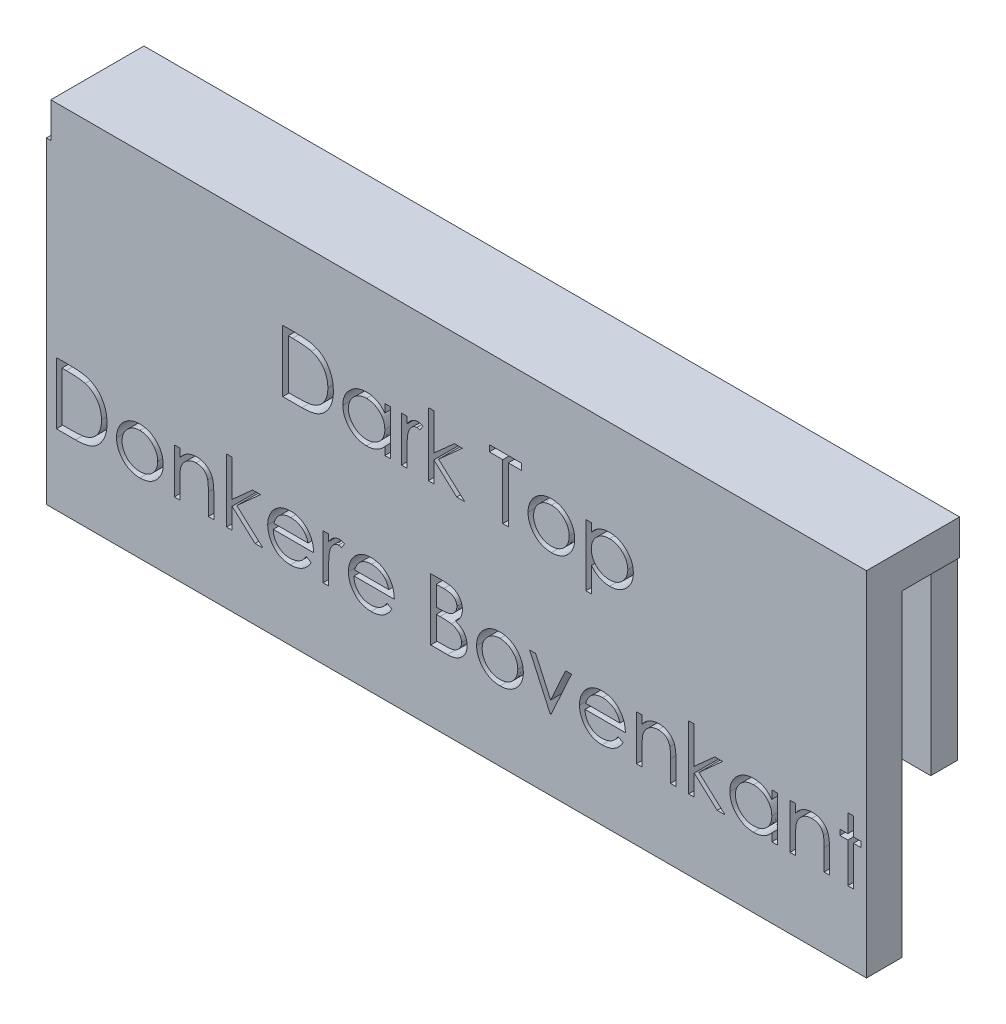
from build123d import *

# Parameters (mm, degrees)
SKETCH1_W           = 46.5
SKETCH1_H           = 18
BOSS_EXTRUDE1_DEPTH = 2
SKETCH3_W           = 46.138929178
SKETCH3_H           = 1.526595811
BOSS_EXTRUDE2_DEPTH = 10
SKETCH4_W           = 46.248898518
SKETCH4_H           = 5.280281263
BOSS_EXTRUDE3_DEPTH = 2
CUT_EXTRUDE1_DEPTH  = 3.753685452


with BuildPart() as part:
    # Sketch1 → Boss-Extrude1 (new body)
    with BuildSketch(Plane.XY):
        with Locations((32.25, 16)):
            Rectangle(SKETCH1_W, SKETCH1_H)
    extrude(amount=BOSS_EXTRUDE1_DEPTH)



with BuildPart() as body_2:
    # Sketch3 → Boss-Extrude2 (new body)
    with BuildSketch(Plane(origin=(0, 15, 0), x_dir=(1, 0, 0), z_dir=(0, 1, 0))):
        with Locations((32.320566071, 2.516983358)):
            Rectangle(SKETCH3_W, SKETCH3_H)
    extrude(amount=BOSS_EXTRUDE2_DEPTH)


with BuildPart() as part_1:
    add(part.part)

    add(body_2.part)  # Boss-Extrude3 merges body 2
    # Sketch4 → Boss-Extrude3 (add)
    with BuildSketch(Plane(origin=(0, 25, 0), x_dir=(1, 0, 0), z_dir=(0, 1, 0))):
        with Locations((32.375550741, 0.640140632)):
            Rectangle(SKETCH4_W, SKETCH4_H)
    extrude(amount=BOSS_EXTRUDE3_DEPTH)

    # Sketch5 → Cut-Extrude1 (cut)
    # profile 1 of 23: a face of its own
    with BuildSketch(Plane.XY.offset(2)):
        with BuildLine():
            Line((22.400641026, 19), (22.400641026, 22.5))
            Line((22.400641026, 22.5), (23.107371795, 22.5))
            add(Edge.make_bspline(
                [(23.107371795, 22.5), (23.226114762, 22.499512509), (23.397841909, 22.497019153), (23.617993927, 22.483682801), (23.763430925, 22.46973216), (23.895897999, 22.452535154), (24.047203509, 22.425420224), (24.152935544, 22.396814059), (24.217948718, 22.373798077)],
                knots=[0, 0, 0, 0, 0.317405911, 0.458843612, 0.589366542, 0.707831319, 0.815770031, 1, 1, 1, 1], degree=3))
            add(Edge.make_bspline(
                [(24.217948718, 22.373798077), (24.298660468, 22.345157912), (24.415537168, 22.29296722), (24.559837015, 22.205056909), (24.661068983, 22.132138506), (24.75386638, 22.049364142), (24.841875204, 21.960309757), (24.921489663, 21.861720678), (24.994398074, 21.755645893), (25.060133541, 21.643333784), (25.117273357, 21.524998694), (25.164724872, 21.401241468), (25.204127571, 21.272406377), (25.235137411, 21.13820978), (25.263981097, 20.94923016), (25.272957551, 20.8040153), (25.272435897, 20.705829327)],
                knots=[0, 0, 0, 0, 0.121694296, 0.181154855, 0.239875389, 0.298701942, 0.357647424, 0.417604843, 0.478494041, 0.540407051, 0.602344994, 0.665004328, 0.728559309, 0.793650542, 0.860534268, 1, 1, 1, 1], degree=3))
            add(Edge.make_bspline(
                [(25.272435897, 20.705829327), (25.272784594, 20.620548838), (25.265265245, 20.49457676), (25.243237649, 20.329763285), (25.218223932, 20.212157015), (25.187813485, 20.097828945), (25.148851419, 19.987996662), (25.104215374, 19.881652863), (25.052165641, 19.780235384), (24.995024218, 19.684152013), (24.933702484, 19.593576485), (24.868265787, 19.509801263), (24.798090154, 19.432572651), (24.724082438, 19.362007073), (24.645758107, 19.297515056), (24.562915056, 19.240358507), (24.475924334, 19.188291377), (24.382248204, 19.142871105), (24.280112339, 19.104440757), (24.169081157, 19.07259552), (24.049427218, 19.046019007), (23.920943665, 19.024964708), (23.73209986, 19.005425584), (23.585660171, 18.999474174), (23.485276442, 19)],
                knots=[0, 0, 0, 0, 0.0908068, 0.134295271, 0.177024386, 0.218822734, 0.260244116, 0.301079867, 0.341613894, 0.381583419, 0.420119591, 0.458074619, 0.494738488, 0.531194623, 0.566933698, 0.602712651, 0.638326606, 0.674853249, 0.713467371, 0.754441804, 0.797815361, 0.843989456, 0.89307157, 1, 1, 1, 1], degree=3))
            Line((23.485276442, 19), (22.400641026, 19))
        make_face()
        with BuildLine():
            Line((22.71474359, 19.358974359), (23.116486378, 19.358974359))
            add(Edge.make_bspline(
                [(23.116486378, 19.358974359), (23.22751167, 19.359028674), (23.387237524, 19.361146542), (23.590784091, 19.370737134), (23.722909451, 19.380292283), (23.841185883, 19.393005752), (23.97212573, 19.410493767), (24.062419234, 19.430822122), (24.116987179, 19.448016827)],
                knots=[0, 0, 0, 0, 0.330627932, 0.475548836, 0.60674619, 0.725023803, 0.829742387, 1, 1, 1, 1], degree=3))
            add(Edge.make_bspline(
                [(24.116987179, 19.448016827), (24.180269389, 19.469478593), (24.273470267, 19.505277121), (24.387704967, 19.570114463), (24.467817908, 19.623501573), (24.542143784, 19.684151626), (24.611568113, 19.750721523), (24.67594985, 19.823556593), (24.734624203, 19.902564674), (24.787132389, 19.98725449), (24.832604048, 20.076793324), (24.872453954, 20.170200112), (24.903738795, 20.26890936), (24.928230134, 20.37203807), (24.951913194, 20.517940332), (24.958363003, 20.630396916), (24.958333333, 20.706530449)],
                knots=[0, 0, 0, 0, 0.123338231, 0.183124538, 0.241782995, 0.300578883, 0.359680075, 0.418881641, 0.479530664, 0.540850536, 0.602303396, 0.664463212, 0.727805723, 0.792894815, 0.859672328, 1, 1, 1, 1], degree=3))
            add(Edge.make_bspline(
                [(24.958333333, 20.706530449), (24.959258379, 20.786969089), (24.95089427, 20.905465395), (24.925586957, 21.059349094), (24.898839655, 21.16832775), (24.864699295, 21.273015981), (24.822107134, 21.372835525), (24.773439857, 21.468840378), (24.715536702, 21.558814776), (24.652121037, 21.643907773), (24.58174326, 21.721863097), (24.505520886, 21.79285589), (24.42428728, 21.858000835), (24.335745482, 21.914643211), (24.209153494, 21.98320693), (24.10641218, 22.021083578), (24.036358173, 22.04286859)],
                knots=[0, 0, 0, 0, 0.137812606, 0.203226247, 0.267174055, 0.330024003, 0.391794272, 0.453084399, 0.514333908, 0.574999993, 0.634865483, 0.694116315, 0.753441622, 0.8131258, 0.874079686, 1, 1, 1, 1], degree=3))
            add(Edge.make_bspline(
                [(24.036358173, 22.04286859), (23.974340468, 22.061625538), (23.872926424, 22.08286318), (23.728134155, 22.103635061), (23.600247105, 22.117744295), (23.459204788, 22.12780531), (23.24469239, 22.138405599), (23.077016327, 22.141412816), (22.96083734, 22.141025641)],
                knots=[0, 0, 0, 0, 0.179284514, 0.286582528, 0.405111483, 0.535592873, 0.67819021, 1, 1, 1, 1], degree=3))
            Line((22.96083734, 22.141025641), (22.71474359, 22.141025641))
            Line((22.71474359, 22.141025641), (22.71474359, 19.358974359))
        make_face(mode=Mode.SUBTRACT)
    # profile 2 of 23: a face of its own
    with BuildSketch(Plane.XY.offset(2)):
        with BuildLine():
            Line((28.503205128, 21.557692308), (28.503205128, 19))
            Line((28.503205128, 19), (28.189102564, 19))
            Line((28.189102564, 19), (28.189102564, 19.442407853))
            add(Edge.make_bspline(
                [(28.189102564, 19.442407853), (28.121865009, 19.362956656), (28.013354058, 19.252427181), (27.846726467, 19.137793014), (27.718060188, 19.069601901), (27.583132982, 19.018478013), (27.393080126, 18.969058407), (27.244667269, 18.954320855), (27.14443109, 18.955128205)],
                knots=[0, 0, 0, 0, 0.262084975, 0.386269912, 0.507164597, 0.627300236, 0.748144942, 1, 1, 1, 1], degree=3))
            add(Edge.make_bspline(
                [(27.14443109, 18.955128205), (27.055401678, 18.955346305), (26.923134567, 18.966840713), (26.753067923, 19.007700185), (26.631794212, 19.04955776), (26.516121838, 19.105150147), (26.4050618, 19.171688245), (26.299189107, 19.250929941), (26.200117508, 19.34151773), (26.108885747, 19.439912778), (26.028823613, 19.544858321), (25.962073665, 19.655900583), (25.906241983, 19.77163391), (25.863288938, 19.892948179), (25.822612362, 20.06365536), (25.811105428, 20.196351016), (25.810897436, 20.285857372)],
                knots=[0, 0, 0, 0, 0.127433484, 0.189004127, 0.249930071, 0.310668454, 0.372328961, 0.43493911, 0.499575544, 0.564191208, 0.626735217, 0.688109334, 0.749293607, 0.810330528, 0.87190117, 1, 1, 1, 1], degree=3))
            add(Edge.make_bspline(
                [(25.810897436, 20.285857372), (25.811415089, 20.373675136), (25.822146564, 20.504289686), (25.864142395, 20.672021703), (25.907651362, 20.791376968), (25.963503709, 20.905717466), (26.031428968, 21.015121372), (26.111448879, 21.11989079), (26.203701069, 21.217562059), (26.30363589, 21.307782484), (26.410544636, 21.386192224), (26.521767811, 21.453906554), (26.639031227, 21.507569328), (26.760596807, 21.550943593), (26.931809442, 21.591623077), (27.064833563, 21.601766481), (27.154246795, 21.602564103)],
                knots=[0, 0, 0, 0, 0.12607881, 0.186904093, 0.247573935, 0.308003356, 0.369131898, 0.432033228, 0.496790794, 0.561610823, 0.624913866, 0.686726349, 0.748078833, 0.809582291, 0.871630743, 1, 1, 1, 1], degree=3))
            add(Edge.make_bspline(
                [(27.154246795, 21.602564103), (27.256439478, 21.602265133), (27.408182809, 21.589145068), (27.600180586, 21.535166133), (27.734843661, 21.4813045), (27.86198021, 21.409613684), (28.023903211, 21.286459543), (28.12717261, 21.169392968), (28.189102564, 21.084435096)],
                knots=[0, 0, 0, 0, 0.254653531, 0.376014554, 0.495255252, 0.614797719, 0.738105554, 1, 1, 1, 1], degree=3))
            Line((28.189102564, 21.084435096), (28.189102564, 21.557692308))
            Line((28.189102564, 21.557692308), (28.503205128, 21.557692308))
        make_face()
        with BuildLine():
            add(Edge.make_bspline(
                [(27.158453526, 21.288461538), (27.067952515, 21.288066301), (26.932577178, 21.273049824), (26.761552147, 21.216499445), (26.640608549, 21.159275626), (26.527940093, 21.08723138), (26.427244928, 21.000114154), (26.337708502, 20.900275853), (26.262376055, 20.788174735), (26.201074958, 20.667994021), (26.143214471, 20.500877014), (26.12384643, 20.369829919), (26.125, 20.282351763)],
                knots=[0, 0, 0, 0, 0.169593435, 0.252475515, 0.336244477, 0.419504521, 0.502035907, 0.584774648, 0.669846475, 0.754184866, 0.836658238, 1, 1, 1, 1], degree=3))
            add(Edge.make_bspline(
                [(26.125, 20.282351763), (26.125747992, 20.195443041), (26.142379399, 20.063917538), (26.202270321, 19.89711593), (26.263445693, 19.775857087), (26.340150357, 19.663272773), (26.429034278, 19.561531369), (26.530985886, 19.474047092), (26.643912768, 19.400789331), (26.764521896, 19.341701907), (26.933990387, 19.286329667), (27.066746622, 19.268811102), (27.155649038, 19.269230769)],
                knots=[0, 0, 0, 0, 0.162858895, 0.245483689, 0.330807139, 0.416493374, 0.499893203, 0.583048156, 0.667157852, 0.751311929, 0.833784789, 1, 1, 1, 1], degree=3))
            add(Edge.make_bspline(
                [(27.155649038, 19.269230769), (27.245961413, 19.26961823), (27.381585989, 19.285241704), (27.554419068, 19.341291483), (27.678204744, 19.399128264), (27.793521022, 19.470902172), (27.897019819, 19.554905054), (27.984532066, 19.652609076), (28.058738685, 19.759986262), (28.116861353, 19.877694462), (28.17439552, 20.047084464), (28.188620824, 20.182569903), (28.189102564, 20.273237179)],
                knots=[0, 0, 0, 0, 0.16866354, 0.252551924, 0.338239689, 0.423102661, 0.505556051, 0.586175656, 0.66713572, 0.74849918, 0.830452399, 1, 1, 1, 1], degree=3))
            add(Edge.make_bspline(
                [(28.189102564, 20.273237179), (28.188905748, 20.342764732), (28.18005492, 20.445820513), (28.148842769, 20.57799272), (28.116529152, 20.671434861), (28.074029212, 20.760070021), (28.022783783, 20.844533747), (27.961877695, 20.924386952), (27.892295177, 20.998530084), (27.816129922, 21.066156311), (27.735535413, 21.12652141), (27.649556591, 21.176107042), (27.559639822, 21.217159938), (27.465627472, 21.24977498), (27.331999486, 21.279451284), (27.228552085, 21.289480206), (27.158453526, 21.288461538)],
                knots=[0, 0, 0, 0, 0.129188088, 0.191218683, 0.251912818, 0.312507474, 0.373494434, 0.4351516, 0.498741474, 0.562095217, 0.624186567, 0.685475718, 0.746096815, 0.807611636, 0.869966581, 1, 1, 1, 1], degree=3))
        make_face(mode=Mode.SUBTRACT)
    # profile 3 of 23: a face of its own
    with BuildSketch(Plane.XY.offset(2)):
        with BuildLine():
            Line((29.131410256, 21.557692308), (29.445512821, 21.557692308))
            Line((29.445512821, 21.557692308), (29.445512821, 21.181189904))
            add(Edge.make_bspline(
                [(29.445512821, 21.181189904), (29.488532949, 21.248903863), (29.556485151, 21.342671547), (29.662282044, 21.445362608), (29.739917907, 21.503890887), (29.820298938, 21.547651227), (29.92787223, 21.590328436), (30.013430825, 21.602175086), (30.069511218, 21.602564103)],
                knots=[0, 0, 0, 0, 0.306112383, 0.438366514, 0.560541455, 0.675317225, 0.786113634, 1, 1, 1, 1], degree=3))
            add(Edge.make_bspline(
                [(30.069511218, 21.602564103), (30.114487671, 21.602214682), (30.210954501, 21.58532168), (30.298607613, 21.541783769), (30.342948718, 21.514923878)],
                knots=[0, 0, 0, 0, 0.463523195, 1, 1, 1, 1], degree=3))
            Line((30.342948718, 21.514923878), (30.170472756, 21.242888622))
            add(Edge.make_bspline(
                [(30.170472756, 21.242888622), (30.141859719, 21.255558956), (30.09038706, 21.278814594), (30.034599905, 21.28813915), (30.009915865, 21.288461538)],
                knots=[0, 0, 0, 0, 0.560229945, 1, 1, 1, 1], degree=3))
            add(Edge.make_bspline(
                [(30.009915865, 21.288461538), (29.95839084, 21.288528061), (29.87951159, 21.269650379), (29.784568478, 21.212815066), (29.726394023, 21.164630107), (29.681352214, 21.118069574), (29.649211787, 21.077423986), (29.61972951, 21.031844468), (29.591557471, 20.982115392), (29.565898539, 20.927383947), (29.533047099, 20.846329102), (29.513525711, 20.781851222), (29.501602564, 20.737379808)],
                knots=[0, 0, 0, 0, 0.191338128, 0.295190617, 0.410312337, 0.471930251, 0.536425159, 0.603118728, 0.674117672, 0.749332023, 0.828283384, 1, 1, 1, 1], degree=3))
            add(Edge.make_bspline(
                [(29.501602564, 20.737379808), (29.489852745, 20.692721974), (29.478388791, 20.617549912), (29.466165031, 20.507810529), (29.459016865, 20.404873905), (29.452463714, 20.28825817), (29.447189435, 20.105002592), (29.444966363, 19.960555982), (29.445512821, 19.859575321)],
                knots=[0, 0, 0, 0, 0.15693815, 0.258600395, 0.37589093, 0.508166168, 0.656237809, 1, 1, 1, 1], degree=3))
            Line((29.445512821, 19.859575321), (29.445512821, 19))
            Line((29.445512821, 19), (29.131410256, 19))
            Line((29.131410256, 19), (29.131410256, 21.557692308))
        make_face()
    # profile 4 of 23: a face of its own
    with BuildSketch(Plane.XY.offset(2)):
        Polygon((30.657051282, 22.58974359), (30.971153846, 22.58974359), (30.971153846, 20.514423077), (32.135016026, 21.557692308), (32.586538462, 21.557692308), (31.236177885, 20.346153846), (32.721153846, 19), (32.270332532, 19), (30.971153846, 20.178585737), (30.971153846, 19), (30.657051282, 19), align=None)
    # profile 5 of 23: a face of its own
    with BuildSketch(Plane.XY.offset(2)):
        Polygon((34.112179487, 22.141025641), (34.112179487, 22.5), (35.951923077, 22.5), (35.951923077, 22.141025641), (35.189102564, 22.141025641), (35.189102564, 19), (34.875, 19), (34.875, 22.141025641), align=None)
    # profile 6 of 23: a face of its own
    with BuildSketch(Plane.XY.offset(2)):
        with BuildLine():
            Line((39.586538462, 21.557692308), (39.900641026, 21.557692308))
            Line((39.900641026, 21.557692308), (39.900641026, 21.084435096))
            add(Edge.make_bspline(
                [(39.900641026, 21.084435096), (39.962806261, 21.169744544), (40.067233953, 21.285678123), (40.228512032, 21.409849364), (40.355627802, 21.481278928), (40.490061009, 21.535042685), (40.681296169, 21.589191887), (40.832373888, 21.602242656), (40.934094551, 21.602564103)],
                knots=[0, 0, 0, 0, 0.263044683, 0.386061082, 0.505770653, 0.625178031, 0.746147722, 1, 1, 1, 1], degree=3))
            add(Edge.make_bspline(
                [(40.934094551, 21.602564103), (41.023727282, 21.60166598), (41.157010901, 21.591706242), (41.328444995, 21.550938221), (41.450011353, 21.507570717), (41.56727487, 21.45390633), (41.678496851, 21.386191711), (41.785410425, 21.307784853), (41.885326664, 21.217552884), (41.977647814, 21.119924578), (42.057494784, 21.014902253), (42.126363847, 20.905939783), (42.182044562, 20.791347255), (42.225613951, 20.672029655), (42.267588185, 20.504284176), (42.278333079, 20.37367799), (42.278846154, 20.285857372)],
                knots=[0, 0, 0, 0, 0.128636051, 0.190652902, 0.252125037, 0.313446276, 0.375227279, 0.438498083, 0.5032851, 0.568009687, 0.630878982, 0.692153504, 0.75255215, 0.813191094, 0.8739854, 1, 1, 1, 1], degree=3))
            add(Edge.make_bspline(
                [(42.278846154, 20.285857372), (42.278642915, 20.196348122), (42.267122102, 20.063660917), (42.226467733, 19.892940214), (42.183452929, 19.771663551), (42.127799811, 19.655679739), (42.060098397, 19.545073383), (41.980211066, 19.439879684), (41.888910177, 19.341526725), (41.789857182, 19.250927643), (41.683979689, 19.171688737), (41.572920835, 19.105150402), (41.457248389, 19.049556281), (41.335973801, 19.007705899), (41.165686674, 18.966755114), (41.033157867, 18.955450922), (40.943910256, 18.955128205)],
                knots=[0, 0, 0, 0, 0.128034164, 0.189573725, 0.250579835, 0.311733221, 0.37325008, 0.435762516, 0.500345561, 0.564949367, 0.627527909, 0.68915729, 0.749865012, 0.8107602, 0.872299761, 1, 1, 1, 1], degree=3))
            add(Edge.make_bspline(
                [(40.943910256, 18.955128205), (40.843440048, 18.953968292), (40.694936254, 18.971131485), (40.504611874, 19.023696798), (40.370410353, 19.080314767), (40.242278022, 19.152616757), (40.077214963, 19.272116864), (39.968182355, 19.38330223), (39.900641026, 19.463441506)],
                knots=[0, 0, 0, 0, 0.250547782, 0.371230204, 0.49211577, 0.613400988, 0.73799732, 1, 1, 1, 1], degree=3))
            Line((39.900641026, 19.463441506), (39.900641026, 18.057692308))
            Line((39.900641026, 18.057692308), (39.586538462, 18.057692308))
            Line((39.586538462, 18.057692308), (39.586538462, 21.557692308))
        make_face()
        with BuildLine():
            add(Edge.make_bspline(
                [(40.931290064, 21.288461538), (40.861184415, 21.289494486), (40.757757666, 21.279423969), (40.624096766, 21.249813953), (40.529973678, 21.216946462), (40.439723363, 21.176535903), (40.354039115, 21.126057042), (40.272981582, 21.06640417), (40.196754498, 20.998725062), (40.127891382, 20.924150314), (40.066927816, 20.84456251), (40.015722848, 20.760062406), (39.973212173, 20.671436898), (39.940901439, 20.577992164), (39.909688236, 20.445820904), (39.900838069, 20.342764528), (39.900641026, 20.273237179)],
                knots=[0, 0, 0, 0, 0.130023749, 0.192374057, 0.253884304, 0.314896085, 0.375805828, 0.438242236, 0.501591268, 0.56488076, 0.626533341, 0.687515765, 0.748105916, 0.808795537, 0.870821519, 1, 1, 1, 1], degree=3))
            add(Edge.make_bspline(
                [(39.900641026, 20.273237179), (39.900808227, 20.182460308), (39.915939267, 20.047367694), (39.971967038, 19.877533489), (40.030437649, 19.760074364), (40.104400692, 19.652091313), (40.193494699, 19.555399662), (40.296938337, 19.470613582), (40.413005423, 19.39917469), (40.537426841, 19.341253105), (40.710578781, 19.285544896), (40.846066558, 19.269400334), (40.936197917, 19.269230769)],
                knots=[0, 0, 0, 0, 0.169344011, 0.251060671, 0.332326431, 0.413189279, 0.494299499, 0.57665388, 0.661784919, 0.74776493, 0.831967435, 1, 1, 1, 1], degree=3))
            add(Edge.make_bspline(
                [(40.936197917, 19.269230769), (41.02467873, 19.268694477), (41.15685196, 19.286590663), (41.325776485, 19.341520469), (41.445958565, 19.401002517), (41.558781248, 19.474013465), (41.660664089, 19.561568022), (41.749666613, 19.66305918), (41.825547617, 19.776068338), (41.886617398, 19.897239881), (41.947870368, 20.063663481), (41.963738885, 20.195530221), (41.96474359, 20.282351763)],
                knots=[0, 0, 0, 0, 0.165573796, 0.248158777, 0.332033307, 0.416257349, 0.49952535, 0.58303856, 0.668595904, 0.75403535, 0.8369197, 1, 1, 1, 1], degree=3))
            add(Edge.make_bspline(
                [(41.96474359, 20.282351763), (41.965975124, 20.369872076), (41.946373339, 20.50079278), (41.888872134, 20.668223283), (41.82640412, 20.787747266), (41.752178315, 20.900520141), (41.662437693, 21.000075363), (41.561819974, 21.087241863), (41.449130579, 21.159272787), (41.328192621, 21.216500195), (41.15716561, 21.273049314), (41.021791488, 21.288066564), (40.931290064, 21.288461538)],
                knots=[0, 0, 0, 0, 0.163349297, 0.245826474, 0.33036716, 0.415198374, 0.497940932, 0.580476126, 0.663740011, 0.747512837, 0.830398741, 1, 1, 1, 1], degree=3))
        make_face(mode=Mode.SUBTRACT)
    # profile 7 of 23: a face of its own
    with BuildSketch(Plane.XY.offset(2)):
        with BuildLine():
            Line((9.567307692, 11), (9.567307692, 14.5))
            Line((9.567307692, 14.5), (10.274038462, 14.5))
            add(Edge.make_bspline(
                [(10.274038462, 14.5), (10.392781429, 14.499512509), (10.564508575, 14.497019153), (10.784660594, 14.483682801), (10.930097592, 14.46973216), (11.062564665, 14.452535154), (11.213870176, 14.425420224), (11.319602211, 14.396814059), (11.384615385, 14.373798077)],
                knots=[0, 0, 0, 0, 0.317405911, 0.458843612, 0.589366542, 0.707831319, 0.815770031, 1, 1, 1, 1], degree=3))
            add(Edge.make_bspline(
                [(11.384615385, 14.373798077), (11.465327135, 14.345157912), (11.582203835, 14.29296722), (11.726503681, 14.205056909), (11.827735649, 14.132138506), (11.920533046, 14.049364142), (12.008541871, 13.960309757), (12.08815633, 13.861720678), (12.161064741, 13.755645893), (12.226800207, 13.643333784), (12.283940024, 13.524998694), (12.331391538, 13.401241468), (12.370794238, 13.272406377), (12.401804078, 13.13820978), (12.430647764, 12.94923016), (12.439624217, 12.8040153), (12.439102564, 12.705829327)],
                knots=[0, 0, 0, 0, 0.121694296, 0.181154855, 0.239875389, 0.298701942, 0.357647424, 0.417604843, 0.478494041, 0.540407051, 0.602344994, 0.665004328, 0.728559309, 0.793650542, 0.860534268, 1, 1, 1, 1], degree=3))
            add(Edge.make_bspline(
                [(12.439102564, 12.705829327), (12.43945126, 12.620548838), (12.431931912, 12.49457676), (12.409904315, 12.329763285), (12.384890599, 12.212157015), (12.354480152, 12.097828945), (12.315518086, 11.987996662), (12.270882041, 11.881652863), (12.218832308, 11.780235384), (12.161690885, 11.684152013), (12.100369151, 11.593576485), (12.034932453, 11.509801263), (11.964756821, 11.432572651), (11.890749104, 11.362007073), (11.812424774, 11.297515056), (11.729581723, 11.240358507), (11.642591, 11.188291377), (11.548914871, 11.142871105), (11.446779006, 11.104440757), (11.335747823, 11.07259552), (11.216093885, 11.046019007), (11.087610332, 11.024964708), (10.898766527, 11.005425584), (10.752326838, 10.999474174), (10.651943109, 11)],
                knots=[0, 0, 0, 0, 0.0908068, 0.134295271, 0.177024386, 0.218822734, 0.260244116, 0.301079867, 0.341613894, 0.381583419, 0.420119591, 0.458074619, 0.494738488, 0.531194623, 0.566933698, 0.602712651, 0.638326606, 0.674853249, 0.713467371, 0.754441804, 0.797815361, 0.843989456, 0.89307157, 1, 1, 1, 1], degree=3))
            Line((10.651943109, 11), (9.567307692, 11))
        make_face()
        with BuildLine():
            Line((9.881410256, 11.358974359), (10.283153045, 11.358974359))
            add(Edge.make_bspline(
                [(10.283153045, 11.358974359), (10.394178337, 11.359028674), (10.55390419, 11.361146542), (10.757450758, 11.370737134), (10.889576118, 11.380292283), (11.007852549, 11.393005752), (11.138792396, 11.410493767), (11.229085901, 11.430822122), (11.283653846, 11.448016827)],
                knots=[0, 0, 0, 0, 0.330627932, 0.475548836, 0.60674619, 0.725023803, 0.829742387, 1, 1, 1, 1], degree=3))
            add(Edge.make_bspline(
                [(11.283653846, 11.448016827), (11.346936056, 11.469478593), (11.440136933, 11.505277121), (11.554371634, 11.570114463), (11.634484575, 11.623501573), (11.708810451, 11.684151626), (11.778234779, 11.750721523), (11.842616516, 11.823556593), (11.90129087, 11.902564674), (11.953799056, 11.98725449), (11.999270714, 12.076793324), (12.03912062, 12.170200112), (12.070405462, 12.26890936), (12.094896801, 12.37203807), (12.11857986, 12.517940332), (12.12502967, 12.630396916), (12.125, 12.706530449)],
                knots=[0, 0, 0, 0, 0.123338231, 0.183124538, 0.241782995, 0.300578883, 0.359680075, 0.418881641, 0.479530664, 0.540850536, 0.602303396, 0.664463212, 0.727805723, 0.792894815, 0.859672328, 1, 1, 1, 1], degree=3))
            add(Edge.make_bspline(
                [(12.125, 12.706530449), (12.125925046, 12.786969089), (12.117560936, 12.905465395), (12.092253624, 13.059349094), (12.065506322, 13.16832775), (12.031365962, 13.273015981), (11.9887738, 13.372835525), (11.940106524, 13.468840378), (11.882203368, 13.558814776), (11.818787704, 13.643907773), (11.748409927, 13.721863097), (11.672187553, 13.79285589), (11.590953947, 13.858000835), (11.502412148, 13.914643211), (11.375820161, 13.98320693), (11.273078846, 14.021083578), (11.20302484, 14.04286859)],
                knots=[0, 0, 0, 0, 0.137812606, 0.203226247, 0.267174055, 0.330024003, 0.391794272, 0.453084399, 0.514333908, 0.574999993, 0.634865483, 0.694116315, 0.753441622, 0.8131258, 0.874079686, 1, 1, 1, 1], degree=3))
            add(Edge.make_bspline(
                [(11.20302484, 14.04286859), (11.141007135, 14.061625538), (11.039593091, 14.08286318), (10.894800822, 14.103635061), (10.766913772, 14.117744295), (10.625871455, 14.12780531), (10.411359057, 14.138405599), (10.243682993, 14.141412816), (10.127504006, 14.141025641)],
                knots=[0, 0, 0, 0, 0.179284514, 0.286582528, 0.405111483, 0.535592873, 0.67819021, 1, 1, 1, 1], degree=3))
            Line((10.127504006, 14.141025641), (9.881410256, 14.141025641))
            Line((9.881410256, 14.141025641), (9.881410256, 11.358974359))
        make_face(mode=Mode.SUBTRACT)
    # profile 8 of 23: a face of its own
    with BuildSketch(Plane.XY.offset(2)):
        with BuildLine():
            Line((16.253205128, 13.557692308), (16.567307692, 13.557692308))
            Line((16.567307692, 13.557692308), (16.567307692, 13.096354167))
            add(Edge.make_bspline(
                [(16.567307692, 13.096354167), (16.630664497, 13.178561429), (16.731559275, 13.293482032), (16.888878314, 13.414042851), (17.00885086, 13.48417829), (17.134479343, 13.536969533), (17.309981272, 13.588560133), (17.448015065, 13.602087862), (17.540464744, 13.602564103)],
                knots=[0, 0, 0, 0, 0.273568781, 0.398988314, 0.519929781, 0.638110022, 0.756588901, 1, 1, 1, 1], degree=3))
            add(Edge.make_bspline(
                [(17.540464744, 13.602564103), (17.632840389, 13.601952327), (17.770716529, 13.586949854), (17.941288329, 13.524198046), (18.057902788, 13.461040562), (18.163031349, 13.382419655), (18.255355849, 13.29084566), (18.331719183, 13.185508562), (18.382916549, 13.087785657), (18.416642141, 13.001096827), (18.437874687, 12.926850085), (18.455904775, 12.844131931), (18.471540347, 12.753192343), (18.482101312, 12.653394152), (18.493734079, 12.503667574), (18.497574824, 12.386876607), (18.496794872, 12.306189904)],
                knots=[0, 0, 0, 0, 0.15117814, 0.223487984, 0.295542644, 0.366976255, 0.437130525, 0.507043616, 0.578559734, 0.616613545, 0.658756237, 0.704491226, 0.754803115, 0.809331625, 0.868274455, 1, 1, 1, 1], degree=3))
            Line((18.496794872, 12.306189904), (18.496794872, 11))
            Line((18.496794872, 11), (18.182692308, 11))
            Line((18.182692308, 11), (18.182692308, 12.203125))
            add(Edge.make_bspline(
                [(18.182692308, 12.203125), (18.182197736, 12.269728048), (18.182086367, 12.365119248), (18.178154047, 12.486412205), (18.174210184, 12.563810846), (18.168412298, 12.632040497), (18.161060568, 12.705037027), (18.152595487, 12.755000164), (18.145532853, 12.78505609)],
                knots=[0, 0, 0, 0, 0.342109649, 0.489825663, 0.623254428, 0.740079676, 0.841482673, 1, 1, 1, 1], degree=3))
            add(Edge.make_bspline(
                [(18.145532853, 12.78505609), (18.128010551, 12.861862731), (18.088334561, 12.971486264), (18.000068543, 13.093063722), (17.922220466, 13.165259607), (17.830981055, 13.221380411), (17.686560365, 13.275604328), (17.56742861, 13.288925676), (17.485777244, 13.288461538)],
                knots=[0, 0, 0, 0, 0.260833163, 0.378476029, 0.493177646, 0.609280965, 0.729981038, 1, 1, 1, 1], degree=3))
            add(Edge.make_bspline(
                [(17.485777244, 13.288461538), (17.435802103, 13.288700689), (17.361068317, 13.283005848), (17.264430862, 13.26211501), (17.194011237, 13.241270212), (17.126503286, 13.212601504), (17.059739035, 13.180073878), (16.996232268, 13.139525185), (16.93462884, 13.094334704), (16.877316158, 13.044255429), (16.823987365, 12.991411045), (16.776451008, 12.93513501), (16.733376225, 12.876336637), (16.696220483, 12.814198995), (16.65269895, 12.727466923), (16.628274398, 12.658434733), (16.615685096, 12.611177885)],
                knots=[0, 0, 0, 0, 0.126626858, 0.188984372, 0.250230194, 0.312351163, 0.374573618, 0.438147531, 0.502920413, 0.567974095, 0.630771334, 0.692934609, 0.754397534, 0.815218352, 0.876116925, 1, 1, 1, 1], degree=3))
            add(Edge.make_bspline(
                [(16.615685096, 12.611177885), (16.606329782, 12.573780116), (16.595891983, 12.512304593), (16.585519306, 12.423400123), (16.57845512, 12.34251367), (16.574155889, 12.251754193), (16.567603679, 12.111594755), (16.567776108, 12.001423166), (16.567307692, 11.924779647)],
                knots=[0, 0, 0, 0, 0.167615077, 0.271052394, 0.389459503, 0.520842802, 0.666398759, 1, 1, 1, 1], degree=3))
            Line((16.567307692, 11.924779647), (16.567307692, 11))
            Line((16.567307692, 11), (16.253205128, 11))
            Line((16.253205128, 11), (16.253205128, 13.557692308))
        make_face()
    # profile 9 of 23: a face of its own
    with BuildSketch(Plane.XY.offset(2)):
        Polygon((19.21474359, 14.58974359), (19.528846154, 14.58974359), (19.528846154, 12.514423077), (20.692708333, 13.557692308), (21.144230769, 13.557692308), (19.793870192, 12.346153846), (21.278846154, 11), (20.82802484, 11), (19.528846154, 12.178585737), (19.528846154, 11), (19.21474359, 11), align=None)
    # profile 10 of 23: a face of its own
    with BuildSketch(Plane.XY.offset(2)):
        with BuildLine():
            Line((23.736979167, 11.807692308), (24.016025641, 11.661157853))
            add(Edge.make_bspline(
                [(24.016025641, 11.661157853), (23.974524805, 11.583465218), (23.905053814, 11.474469332), (23.79810793, 11.344707178), (23.713034937, 11.262960759), (23.623357331, 11.19171381), (23.528626744, 11.129374293), (23.428337429, 11.076258211), (23.322487612, 11.031497519), (23.210188963, 10.997119284), (23.04780569, 10.963793586), (22.920929208, 10.955139365), (22.834635417, 10.955128205)],
                knots=[0, 0, 0, 0, 0.181660766, 0.265874227, 0.346354784, 0.424599862, 0.501903184, 0.579992091, 0.658443431, 0.738672236, 0.821894148, 1, 1, 1, 1], degree=3))
            add(Edge.make_bspline(
                [(22.834635417, 10.955128205), (22.738864737, 10.955167088), (22.597943041, 10.966163371), (22.418711198, 11.009309726), (22.295501146, 11.0532354), (22.180758468, 11.110673027), (22.074257723, 11.180629776), (21.975438178, 11.262762771), (21.887413933, 11.357779015), (21.808170214, 11.459461018), (21.738243794, 11.565416919), (21.679788536, 11.675380035), (21.632227956, 11.788650969), (21.593852559, 11.904513344), (21.557771275, 12.064960489), (21.54899165, 12.188812296), (21.548076923, 12.271834936)],
                knots=[0, 0, 0, 0, 0.139629225, 0.204796697, 0.268134963, 0.329813747, 0.391301398, 0.453433515, 0.51655169, 0.579631271, 0.641118921, 0.701294047, 0.760810336, 0.819931722, 0.878919575, 1, 1, 1, 1], degree=3))
            add(Edge.make_bspline(
                [(21.548076923, 12.271834936), (21.549030211, 12.349628638), (21.556306291, 12.465757498), (21.587933671, 12.616301209), (21.620081104, 12.725188901), (21.661660205, 12.830729151), (21.729832982, 12.968240187), (21.794996814, 13.064309458), (21.842548077, 13.125801282)],
                knots=[0, 0, 0, 0, 0.2537679, 0.377428427, 0.500550841, 0.623295883, 0.746578332, 1, 1, 1, 1], degree=3))
            add(Edge.make_bspline(
                [(21.842548077, 13.125801282), (21.903121137, 13.201525831), (22.001889113, 13.307407667), (22.156551265, 13.418170194), (22.278128288, 13.486209739), (22.408469722, 13.537842269), (22.595015748, 13.590336672), (22.742891545, 13.601365522), (22.842347756, 13.602564103)],
                knots=[0, 0, 0, 0, 0.253589335, 0.374643257, 0.495340042, 0.616324775, 0.739759335, 1, 1, 1, 1], degree=3))
            add(Edge.make_bspline(
                [(22.842347756, 13.602564103), (22.945175258, 13.602996076), (23.097083519, 13.588115871), (23.289676582, 13.53482662), (23.423520928, 13.479740989), (23.549190439, 13.408529242), (23.707465615, 13.289458457), (23.810908529, 13.179818766), (23.872295673, 13.099158654)],
                knots=[0, 0, 0, 0, 0.259032841, 0.381879824, 0.502258444, 0.62275219, 0.744742632, 1, 1, 1, 1], degree=3))
            add(Edge.make_bspline(
                [(23.872295673, 13.099158654), (23.918182325, 13.04026983), (23.978091365, 12.944630667), (24.041702133, 12.807844645), (24.080078911, 12.698962911), (24.111089044, 12.585136561), (24.141690527, 12.422780442), (24.149051561, 12.296798103), (24.150641026, 12.211538462)],
                knots=[0, 0, 0, 0, 0.236254763, 0.356174434, 0.477249655, 0.601539871, 0.729618382, 1, 1, 1, 1], degree=3))
            Line((24.150641026, 12.211538462), (21.862179487, 12.211538462))
            add(Edge.make_bspline(
                [(21.862179487, 12.211538462), (21.863968212, 12.145292451), (21.872848558, 12.047436192), (21.903129089, 11.922222901), (21.934374854, 11.835140321), (21.972247768, 11.752210074), (22.018631865, 11.674048066), (22.073971858, 11.601010141), (22.135697437, 11.532442954), (22.204404567, 11.471382382), (22.276687296, 11.416729918), (22.353580898, 11.370926843), (22.434478851, 11.333737581), (22.519251126, 11.30466651), (22.639233191, 11.27760005), (22.732361442, 11.268881085), (22.795372596, 11.269230769)],
                knots=[0, 0, 0, 0, 0.134475588, 0.198391058, 0.260753477, 0.321829223, 0.383037238, 0.444653123, 0.507398011, 0.569825238, 0.630777641, 0.690928687, 0.750945133, 0.811049477, 0.872330853, 1, 1, 1, 1], degree=3))
            add(Edge.make_bspline(
                [(22.795372596, 11.269230769), (22.8575665, 11.268929938), (22.950862732, 11.276253), (23.072711026, 11.301772582), (23.161971769, 11.327630859), (23.247542581, 11.359216089), (23.326788479, 11.397316602), (23.399667423, 11.439467744), (23.467789042, 11.487674102), (23.533840882, 11.546695427), (23.627338671, 11.651514358), (23.694454441, 11.741144824), (23.736979167, 11.807692308)],
                knots=[0, 0, 0, 0, 0.163878894, 0.24565874, 0.327725695, 0.408609961, 0.485749086, 0.559169056, 0.630268476, 0.705306028, 0.792064966, 1, 1, 1, 1], degree=3))
        make_face()
        with BuildLine():
            Line((21.895132212, 12.525641026), (23.836538462, 12.525641026))
            add(Edge.make_bspline(
                [(23.836538462, 12.525641026), (23.816664663, 12.60638204), (23.777049286, 12.720303304), (23.704577899, 12.857213239), (23.642992186, 12.942801791), (23.573164174, 13.018802755), (23.492521579, 13.085223014), (23.402084818, 13.144636168), (23.302326475, 13.19480502), (23.196682362, 13.237432508), (23.048874881, 13.275998431), (22.934915962, 13.289602535), (22.858473558, 13.288461538)],
                knots=[0, 0, 0, 0, 0.185231261, 0.267500523, 0.344400382, 0.419594869, 0.496890627, 0.576637919, 0.660267852, 0.745386615, 0.830040327, 1, 1, 1, 1], degree=3))
            add(Edge.make_bspline(
                [(22.858473558, 13.288461538), (22.7965482, 13.288613676), (22.704514307, 13.281916972), (22.58617214, 13.256189326), (22.501464313, 13.230253659), (22.42085601, 13.19562709), (22.315835983, 13.141211507), (22.24493594, 13.086968898), (22.199419071, 13.048677885)],
                knots=[0, 0, 0, 0, 0.259141276, 0.384161763, 0.505991952, 0.629098089, 0.750669123, 1, 1, 1, 1], degree=3))
            add(Edge.make_bspline(
                [(22.199419071, 13.048677885), (22.164538391, 13.01929537), (22.117332017, 12.968413201), (22.060602521, 12.893633931), (22.021239816, 12.830617227), (21.985181534, 12.761985632), (21.938963304, 12.661365787), (21.911566418, 12.580972868), (21.895132212, 12.525641026)],
                knots=[0, 0, 0, 0, 0.222580497, 0.338499871, 0.458708565, 0.585535346, 0.717517743, 1, 1, 1, 1], degree=3))
        make_face(mode=Mode.SUBTRACT)
    # profile 11 of 23: a face of its own
    with BuildSketch(Plane.XY.offset(2)):
        with BuildLine():
            Line((24.689102564, 13.557692308), (25.003205128, 13.557692308))
            Line((25.003205128, 13.557692308), (25.003205128, 13.181189904))
            add(Edge.make_bspline(
                [(25.003205128, 13.181189904), (25.046225256, 13.248903863), (25.114177459, 13.342671547), (25.219974352, 13.445362608), (25.297610215, 13.503890887), (25.377991246, 13.547651227), (25.485564538, 13.590328436), (25.571123133, 13.602175086), (25.627203526, 13.602564103)],
                knots=[0, 0, 0, 0, 0.306112383, 0.438366514, 0.560541455, 0.675317225, 0.786113634, 1, 1, 1, 1], degree=3))
            add(Edge.make_bspline(
                [(25.627203526, 13.602564103), (25.672179979, 13.602214682), (25.768646809, 13.58532168), (25.856299921, 13.541783769), (25.900641026, 13.514923878)],
                knots=[0, 0, 0, 0, 0.463523195, 1, 1, 1, 1], degree=3))
            Line((25.900641026, 13.514923878), (25.728165064, 13.242888622))
            add(Edge.make_bspline(
                [(25.728165064, 13.242888622), (25.699552026, 13.255558956), (25.648079368, 13.278814594), (25.592292213, 13.28813915), (25.567608173, 13.288461538)],
                knots=[0, 0, 0, 0, 0.560229945, 1, 1, 1, 1], degree=3))
            add(Edge.make_bspline(
                [(25.567608173, 13.288461538), (25.516083148, 13.288528061), (25.437203898, 13.269650379), (25.342260786, 13.212815066), (25.284086331, 13.164630107), (25.239044522, 13.118069574), (25.206904095, 13.077423986), (25.177421818, 13.031844468), (25.149249779, 12.982115392), (25.123590846, 12.927383947), (25.090739406, 12.846329102), (25.071218019, 12.781851222), (25.059294872, 12.737379808)],
                knots=[0, 0, 0, 0, 0.191338128, 0.295190617, 0.410312337, 0.471930251, 0.536425159, 0.603118728, 0.674117672, 0.749332023, 0.828283384, 1, 1, 1, 1], degree=3))
            add(Edge.make_bspline(
                [(25.059294872, 12.737379808), (25.047545053, 12.692721974), (25.036081099, 12.617549912), (25.023857339, 12.507810529), (25.016709172, 12.404873905), (25.010156021, 12.28825817), (25.004881742, 12.105002592), (25.002658671, 11.960555982), (25.003205128, 11.859575321)],
                knots=[0, 0, 0, 0, 0.15693815, 0.258600395, 0.37589093, 0.508166168, 0.656237809, 1, 1, 1, 1], degree=3))
            Line((25.003205128, 11.859575321), (25.003205128, 11))
            Line((25.003205128, 11), (24.689102564, 11))
            Line((24.689102564, 11), (24.689102564, 13.557692308))
        make_face()
    # profile 12 of 23: a face of its own
    with BuildSketch(Plane.XY.offset(2)):
        with BuildLine():
            Line((28.313902244, 11.807692308), (28.592948718, 11.661157853))
            add(Edge.make_bspline(
                [(28.592948718, 11.661157853), (28.551447882, 11.583465218), (28.481976891, 11.474469332), (28.375031007, 11.344707178), (28.289958014, 11.262960759), (28.200280408, 11.19171381), (28.105549821, 11.129374293), (28.005260506, 11.076258211), (27.899410689, 11.031497519), (27.78711204, 10.997119284), (27.624728767, 10.963793586), (27.497852285, 10.955139365), (27.411558494, 10.955128205)],
                knots=[0, 0, 0, 0, 0.181660766, 0.265874227, 0.346354784, 0.424599862, 0.501903184, 0.579992091, 0.658443431, 0.738672236, 0.821894148, 1, 1, 1, 1], degree=3))
            add(Edge.make_bspline(
                [(27.411558494, 10.955128205), (27.315787814, 10.955167088), (27.174866118, 10.966163371), (26.995634275, 11.009309726), (26.872424223, 11.0532354), (26.757681544, 11.110673027), (26.6511808, 11.180629776), (26.552361255, 11.262762771), (26.464337009, 11.357779015), (26.38509329, 11.459461018), (26.315166871, 11.565416919), (26.256711613, 11.675380035), (26.209151033, 11.788650969), (26.170775636, 11.904513344), (26.134694352, 12.064960489), (26.125914727, 12.188812296), (26.125, 12.271834936)],
                knots=[0, 0, 0, 0, 0.139629225, 0.204796697, 0.268134963, 0.329813747, 0.391301398, 0.453433515, 0.51655169, 0.579631271, 0.641118921, 0.701294047, 0.760810336, 0.819931722, 0.878919575, 1, 1, 1, 1], degree=3))
            add(Edge.make_bspline(
                [(26.125, 12.271834936), (26.125953288, 12.349628638), (26.133229368, 12.465757498), (26.164856748, 12.616301209), (26.197004181, 12.725188901), (26.238583282, 12.830729151), (26.306756059, 12.968240187), (26.371919891, 13.064309458), (26.419471154, 13.125801282)],
                knots=[0, 0, 0, 0, 0.2537679, 0.377428427, 0.500550841, 0.623295883, 0.746578332, 1, 1, 1, 1], degree=3))
            add(Edge.make_bspline(
                [(26.419471154, 13.125801282), (26.480044214, 13.201525831), (26.57881219, 13.307407667), (26.733474342, 13.418170194), (26.855051365, 13.486209739), (26.985392799, 13.537842269), (27.171938825, 13.590336672), (27.319814622, 13.601365522), (27.419270833, 13.602564103)],
                knots=[0, 0, 0, 0, 0.253589335, 0.374643257, 0.495340042, 0.616324775, 0.739759335, 1, 1, 1, 1], degree=3))
            add(Edge.make_bspline(
                [(27.419270833, 13.602564103), (27.522098335, 13.602996076), (27.674006596, 13.588115871), (27.866599659, 13.53482662), (28.000444005, 13.479740989), (28.126113516, 13.408529242), (28.284388692, 13.289458457), (28.387831606, 13.179818766), (28.44921875, 13.099158654)],
                knots=[0, 0, 0, 0, 0.259032841, 0.381879824, 0.502258444, 0.62275219, 0.744742632, 1, 1, 1, 1], degree=3))
            add(Edge.make_bspline(
                [(28.44921875, 13.099158654), (28.495105402, 13.04026983), (28.555014442, 12.944630667), (28.61862521, 12.807844645), (28.657001988, 12.698962911), (28.688012121, 12.585136561), (28.718613604, 12.422780442), (28.725974638, 12.296798103), (28.727564103, 12.211538462)],
                knots=[0, 0, 0, 0, 0.236254763, 0.356174434, 0.477249655, 0.601539871, 0.729618382, 1, 1, 1, 1], degree=3))
            Line((28.727564103, 12.211538462), (26.439102564, 12.211538462))
            add(Edge.make_bspline(
                [(26.439102564, 12.211538462), (26.440891289, 12.145292451), (26.449771635, 12.047436192), (26.480052166, 11.922222901), (26.511297931, 11.835140321), (26.549170845, 11.752210074), (26.595554942, 11.674048066), (26.650894935, 11.601010141), (26.712620513, 11.532442954), (26.781327643, 11.471382382), (26.853610373, 11.416729918), (26.930503975, 11.370926843), (27.011401928, 11.333737581), (27.096174203, 11.30466651), (27.216156268, 11.27760005), (27.309284519, 11.268881085), (27.372295673, 11.269230769)],
                knots=[0, 0, 0, 0, 0.134475588, 0.198391058, 0.260753477, 0.321829223, 0.383037238, 0.444653123, 0.507398011, 0.569825238, 0.630777641, 0.690928687, 0.750945133, 0.811049477, 0.872330853, 1, 1, 1, 1], degree=3))
            add(Edge.make_bspline(
                [(27.372295673, 11.269230769), (27.434489577, 11.268929938), (27.527785809, 11.276253), (27.649634103, 11.301772582), (27.738894846, 11.327630859), (27.824465658, 11.359216089), (27.903711556, 11.397316602), (27.9765905, 11.439467744), (28.044712119, 11.487674102), (28.110763959, 11.546695427), (28.204261748, 11.651514358), (28.271377518, 11.741144824), (28.313902244, 11.807692308)],
                knots=[0, 0, 0, 0, 0.163878894, 0.24565874, 0.327725695, 0.408609961, 0.485749086, 0.559169056, 0.630268476, 0.705306028, 0.792064966, 1, 1, 1, 1], degree=3))
        make_face()
        with BuildLine():
            Line((26.472055288, 12.525641026), (28.413461538, 12.525641026))
            add(Edge.make_bspline(
                [(28.413461538, 12.525641026), (28.393587739, 12.60638204), (28.353972363, 12.720303304), (28.281500976, 12.857213239), (28.219915263, 12.942801791), (28.150087251, 13.018802755), (28.069444656, 13.085223014), (27.979007895, 13.144636168), (27.879249552, 13.19480502), (27.773605439, 13.237432508), (27.625797958, 13.275998431), (27.511839039, 13.289602535), (27.435396635, 13.288461538)],
                knots=[0, 0, 0, 0, 0.185231261, 0.267500523, 0.344400382, 0.419594869, 0.496890627, 0.576637919, 0.660267852, 0.745386615, 0.830040327, 1, 1, 1, 1], degree=3))
            add(Edge.make_bspline(
                [(27.435396635, 13.288461538), (27.373471277, 13.288613676), (27.281437384, 13.281916972), (27.163095217, 13.256189326), (27.07838739, 13.230253659), (26.997779087, 13.19562709), (26.89275906, 13.141211507), (26.821859017, 13.086968898), (26.776342147, 13.048677885)],
                knots=[0, 0, 0, 0, 0.259141276, 0.384161763, 0.505991952, 0.629098089, 0.750669123, 1, 1, 1, 1], degree=3))
            add(Edge.make_bspline(
                [(26.776342147, 13.048677885), (26.741461468, 13.01929537), (26.694255094, 12.968413201), (26.637525598, 12.893633931), (26.598162893, 12.830617227), (26.562104611, 12.761985632), (26.515886381, 12.661365787), (26.488489495, 12.580972868), (26.472055288, 12.525641026)],
                knots=[0, 0, 0, 0, 0.222580497, 0.338499871, 0.458708565, 0.585535346, 0.717517743, 1, 1, 1, 1], degree=3))
        make_face(mode=Mode.SUBTRACT)
    # profile 13 of 23: a face of its own
    with BuildSketch(Plane.XY.offset(2)):
        with BuildLine():
            Line((30.791666667, 14.5), (31.474559295, 14.5))
            add(Edge.make_bspline(
                [(31.474559295, 14.5), (31.539364063, 14.500543205), (31.633678697, 14.496991903), (31.755248575, 14.486985018), (31.837552547, 14.475569571), (31.913873201, 14.461774242), (31.984440852, 14.445073281), (32.049031012, 14.425046462), (32.126143794, 14.39320024), (32.214064135, 14.345877048), (32.309263813, 14.275948476), (32.390663248, 14.190416067), (32.460867931, 14.0939332), (32.51660008, 13.987798225), (32.571182456, 13.835622152), (32.58729122, 13.714316445), (32.586538462, 13.63271234)],
                knots=[0, 0, 0, 0, 0.121322939, 0.176680142, 0.228365096, 0.276868446, 0.321879128, 0.364098625, 0.403355696, 0.477967948, 0.550535461, 0.623584457, 0.698174882, 0.77335367, 0.847281125, 1, 1, 1, 1], degree=3))
            add(Edge.make_bspline(
                [(32.586538462, 13.63271234), (32.587090709, 13.556786512), (32.574240914, 13.44402404), (32.53055077, 13.301259851), (32.485901929, 13.201229703), (32.42777411, 13.109226811), (32.334994809, 12.994750206), (32.244820519, 12.927918167), (32.181991186, 12.888120994)],
                knots=[0, 0, 0, 0, 0.256580609, 0.380551617, 0.503622917, 0.625739323, 0.747548582, 1, 1, 1, 1], degree=3))
            add(Edge.make_bspline(
                [(32.181991186, 12.888120994), (32.258309495, 12.859976747), (32.366316421, 12.814643907), (32.492701082, 12.735840104), (32.569101908, 12.674523921), (32.634438535, 12.60841125), (32.691492182, 12.536557108), (32.740171689, 12.458018219), (32.781891523, 12.373614204), (32.814414, 12.284209831), (32.847371979, 12.158198436), (32.855111239, 12.059667861), (32.855769231, 11.993489583)],
                knots=[0, 0, 0, 0, 0.202914257, 0.290300165, 0.370222566, 0.446383721, 0.5213969, 0.598291083, 0.676142469, 0.7555287, 0.834887172, 1, 1, 1, 1], degree=3))
            add(Edge.make_bspline(
                [(32.855769231, 11.993489583), (32.855302689, 11.926349575), (32.847249394, 11.826508586), (32.814658979, 11.698967058), (32.781616185, 11.608363516), (32.738446229, 11.52170294), (32.685920359, 11.438889794), (32.623288219, 11.360755443), (32.553225511, 11.286431781), (32.473963321, 11.219604175), (32.38844758, 11.160087781), (32.295601247, 11.11114431), (32.196949294, 11.07001831), (32.09138482, 11.038650178), (31.938504695, 11.008447871), (31.81939962, 10.999045399), (31.73818109, 11)],
                knots=[0, 0, 0, 0, 0.120334558, 0.178180255, 0.235235126, 0.292682961, 0.351186248, 0.41045661, 0.471719854, 0.533761203, 0.595739024, 0.657887515, 0.72129518, 0.786822515, 0.854686154, 1, 1, 1, 1], degree=3))
            Line((31.73818109, 11), (30.791666667, 11))
            Line((30.791666667, 11), (30.791666667, 14.5))
        make_face()
        with BuildLine():
            Line((31.105769231, 14.141025641), (31.105769231, 13.019230769))
            Line((31.105769231, 13.019230769), (31.316806891, 13.019230769))
            add(Edge.make_bspline(
                [(31.316806891, 13.019230769), (31.376376184, 13.020357098), (31.462813188, 13.020265137), (31.573707237, 13.028810411), (31.647498483, 13.03501231), (31.714841063, 13.045085585), (31.775584896, 13.057078016), (31.830683487, 13.069760851), (31.894223085, 13.091330355), (31.966295666, 13.123208036), (32.043130226, 13.172679816), (32.110859451, 13.231604382), (32.168076163, 13.29959455), (32.214815829, 13.374463654), (32.258675862, 13.48223896), (32.27378739, 13.568448154), (32.272435897, 13.626402244)],
                knots=[0, 0, 0, 0, 0.139700332, 0.202288511, 0.260599533, 0.313190329, 0.361738933, 0.405706476, 0.445539985, 0.518831956, 0.58977824, 0.658867479, 0.728430478, 0.797282704, 0.864815377, 1, 1, 1, 1], degree=3))
            add(Edge.make_bspline(
                [(32.272435897, 13.626402244), (32.272283003, 13.664430353), (32.267652587, 13.720731045), (32.248043731, 13.791728038), (32.229605789, 13.841380704), (32.203812798, 13.886892934), (32.173450485, 13.929836028), (32.136764476, 13.968748174), (32.095007251, 14.005117668), (32.046998607, 14.037362182), (31.992767305, 14.06560301), (31.931579698, 14.08834352), (31.864466542, 14.10826079), (31.790396709, 14.122244441), (31.679435058, 14.138398454), (31.592117872, 14.140530721), (31.532051282, 14.141025641)],
                knots=[0, 0, 0, 0, 0.111817869, 0.164402372, 0.215869805, 0.26684111, 0.317478963, 0.369902136, 0.423400449, 0.479718398, 0.539241497, 0.602430689, 0.671029546, 0.744484798, 0.823453971, 1, 1, 1, 1], degree=3))
            Line((31.532051282, 14.141025641), (31.105769231, 14.141025641))
        make_face(mode=Mode.SUBTRACT)
        with BuildLine():
            Line((31.105769231, 12.66025641), (31.105769231, 11.358974359))
            Line((31.105769231, 11.358974359), (31.553084936, 11.358974359))
            add(Edge.make_bspline(
                [(31.553084936, 11.358974359), (31.614781761, 11.359873256), (31.703952127, 11.360399006), (31.818500652, 11.36800252), (31.894188544, 11.376650884), (31.963799053, 11.386028746), (32.026496746, 11.398640165), (32.082789932, 11.413089094), (32.148064283, 11.435423275), (32.221567483, 11.470119739), (32.300779572, 11.52243398), (32.37120128, 11.584757239), (32.431023482, 11.656888334), (32.479974529, 11.735318998), (32.527604026, 11.845707988), (32.541749022, 11.934552271), (32.541666667, 11.993489583)],
                knots=[0, 0, 0, 0, 0.139738989, 0.201795135, 0.259821934, 0.312205989, 0.360773434, 0.404540343, 0.443698099, 0.516840794, 0.587874336, 0.657965418, 0.728969389, 0.79930772, 0.866635778, 1, 1, 1, 1], degree=3))
            add(Edge.make_bspline(
                [(32.541666667, 11.993489583), (32.542441611, 12.030195398), (32.536837674, 12.084581946), (32.520547496, 12.154812719), (32.505042386, 12.205490827), (32.482415896, 12.253704035), (32.456011331, 12.300406913), (32.425049208, 12.345659267), (32.376806233, 12.402877305), (32.306626127, 12.468748454), (32.169945503, 12.557521272), (32.051575256, 12.599632184), (31.96885016, 12.618890224)],
                knots=[0, 0, 0, 0, 0.119602355, 0.177503371, 0.235142664, 0.292132593, 0.350871209, 0.410097863, 0.470731522, 0.594828704, 0.722578824, 1, 1, 1, 1], degree=3))
            add(Edge.make_bspline(
                [(31.96885016, 12.618890224), (31.932060866, 12.627094302), (31.871987555, 12.636050912), (31.78595154, 12.644770438), (31.708533277, 12.650008142), (31.622323819, 12.655377799), (31.48975834, 12.658354153), (31.386006401, 12.660684702), (31.314002404, 12.66025641)],
                knots=[0, 0, 0, 0, 0.171952819, 0.277056507, 0.394730576, 0.526177321, 0.671344767, 1, 1, 1, 1], degree=3))
            Line((31.314002404, 12.66025641), (31.105769231, 12.66025641))
        make_face(mode=Mode.SUBTRACT)
    # profile 14 of 23: a face of its own
    with BuildSketch(Plane.XY.offset(2)):
        Polygon((36.400641026, 13.557692308), (36.740685096, 13.557692308), (37.58974359, 11.695512821), (38.438802083, 13.557692308), (38.778846154, 13.557692308), (37.612179487, 11), (37.567307692, 11), align=None)
    # profile 15 of 23: a face of its own
    with BuildSketch(Plane.XY.offset(2)):
        with BuildLine():
            Line((41.416466346, 11.807692308), (41.695512821, 11.661157853))
            add(Edge.make_bspline(
                [(41.695512821, 11.661157853), (41.654011984, 11.583465218), (41.584540994, 11.474469332), (41.47759511, 11.344707178), (41.392522117, 11.262960759), (41.302844511, 11.19171381), (41.208113924, 11.129374293), (41.107824608, 11.076258211), (41.001974792, 11.031497519), (40.889676142, 10.997119284), (40.72729287, 10.963793586), (40.600416388, 10.955139365), (40.514122596, 10.955128205)],
                knots=[0, 0, 0, 0, 0.181660766, 0.265874227, 0.346354784, 0.424599862, 0.501903184, 0.579992091, 0.658443431, 0.738672236, 0.821894148, 1, 1, 1, 1], degree=3))
            add(Edge.make_bspline(
                [(40.514122596, 10.955128205), (40.418351916, 10.955167088), (40.277430221, 10.966163371), (40.098198378, 11.009309726), (39.974988326, 11.0532354), (39.860245647, 11.110673027), (39.753744902, 11.180629776), (39.654925358, 11.262762771), (39.566901112, 11.357779015), (39.487657393, 11.459461018), (39.417730974, 11.565416919), (39.359275715, 11.675380035), (39.311715135, 11.788650969), (39.273339738, 11.904513344), (39.237258454, 12.064960489), (39.22847883, 12.188812296), (39.227564103, 12.271834936)],
                knots=[0, 0, 0, 0, 0.139629225, 0.204796697, 0.268134963, 0.329813747, 0.391301398, 0.453433515, 0.51655169, 0.579631271, 0.641118921, 0.701294047, 0.760810336, 0.819931722, 0.878919575, 1, 1, 1, 1], degree=3))
            add(Edge.make_bspline(
                [(39.227564103, 12.271834936), (39.228517391, 12.349628638), (39.235793471, 12.465757498), (39.26742085, 12.616301209), (39.299568283, 12.725188901), (39.341147385, 12.830729151), (39.409320161, 12.968240187), (39.474483994, 13.064309458), (39.522035256, 13.125801282)],
                knots=[0, 0, 0, 0, 0.2537679, 0.377428427, 0.500550841, 0.623295883, 0.746578332, 1, 1, 1, 1], degree=3))
            add(Edge.make_bspline(
                [(39.522035256, 13.125801282), (39.582608317, 13.201525831), (39.681376292, 13.307407667), (39.836038444, 13.418170194), (39.957615467, 13.486209739), (40.087956902, 13.537842269), (40.274502928, 13.590336672), (40.422378725, 13.601365522), (40.521834936, 13.602564103)],
                knots=[0, 0, 0, 0, 0.253589335, 0.374643257, 0.495340042, 0.616324775, 0.739759335, 1, 1, 1, 1], degree=3))
            add(Edge.make_bspline(
                [(40.521834936, 13.602564103), (40.624662438, 13.602996076), (40.776570699, 13.588115871), (40.969163762, 13.53482662), (41.103008107, 13.479740989), (41.228677619, 13.408529242), (41.386952795, 13.289458457), (41.490395709, 13.179818766), (41.551782853, 13.099158654)],
                knots=[0, 0, 0, 0, 0.259032841, 0.381879824, 0.502258444, 0.62275219, 0.744742632, 1, 1, 1, 1], degree=3))
            add(Edge.make_bspline(
                [(41.551782853, 13.099158654), (41.597669504, 13.04026983), (41.657578545, 12.944630667), (41.721189313, 12.807844645), (41.75956609, 12.698962911), (41.790576224, 12.585136561), (41.821177707, 12.422780442), (41.82853874, 12.296798103), (41.830128205, 12.211538462)],
                knots=[0, 0, 0, 0, 0.236254763, 0.356174434, 0.477249655, 0.601539871, 0.729618382, 1, 1, 1, 1], degree=3))
            Line((41.830128205, 12.211538462), (39.541666667, 12.211538462))
            add(Edge.make_bspline(
                [(39.541666667, 12.211538462), (39.543455391, 12.145292451), (39.552335738, 12.047436192), (39.582616268, 11.922222901), (39.613862033, 11.835140321), (39.651734948, 11.752210074), (39.698119044, 11.674048066), (39.753459037, 11.601010141), (39.815184616, 11.532442954), (39.883891746, 11.471382382), (39.956174475, 11.416729918), (40.033068078, 11.370926843), (40.11396603, 11.333737581), (40.198738305, 11.30466651), (40.31872037, 11.27760005), (40.411848621, 11.268881085), (40.474859776, 11.269230769)],
                knots=[0, 0, 0, 0, 0.134475588, 0.198391058, 0.260753477, 0.321829223, 0.383037238, 0.444653123, 0.507398011, 0.569825238, 0.630777641, 0.690928687, 0.750945133, 0.811049477, 0.872330853, 1, 1, 1, 1], degree=3))
            add(Edge.make_bspline(
                [(40.474859776, 11.269230769), (40.53705368, 11.268929938), (40.630349912, 11.276253), (40.752198205, 11.301772582), (40.841458949, 11.327630859), (40.92702976, 11.359216089), (41.006275659, 11.397316602), (41.079154603, 11.439467744), (41.147276222, 11.487674102), (41.213328061, 11.546695427), (41.30682585, 11.651514358), (41.37394162, 11.741144824), (41.416466346, 11.807692308)],
                knots=[0, 0, 0, 0, 0.163878894, 0.24565874, 0.327725695, 0.408609961, 0.485749086, 0.559169056, 0.630268476, 0.705306028, 0.792064966, 1, 1, 1, 1], degree=3))
        make_face()
        with BuildLine():
            Line((39.574619391, 12.525641026), (41.516025641, 12.525641026))
            add(Edge.make_bspline(
                [(41.516025641, 12.525641026), (41.496151842, 12.60638204), (41.456536465, 12.720303304), (41.384065079, 12.857213239), (41.322479366, 12.942801791), (41.252651353, 13.018802755), (41.172008759, 13.085223014), (41.081571997, 13.144636168), (40.981813655, 13.19480502), (40.876169541, 13.237432508), (40.72836206, 13.275998431), (40.614403142, 13.289602535), (40.537960737, 13.288461538)],
                knots=[0, 0, 0, 0, 0.185231261, 0.267500523, 0.344400382, 0.419594869, 0.496890627, 0.576637919, 0.660267852, 0.745386615, 0.830040327, 1, 1, 1, 1], degree=3))
            add(Edge.make_bspline(
                [(40.537960737, 13.288461538), (40.476035379, 13.288613676), (40.384001487, 13.281916972), (40.26565932, 13.256189326), (40.180951493, 13.230253659), (40.100343189, 13.19562709), (39.995323163, 13.141211507), (39.924423119, 13.086968898), (39.87890625, 13.048677885)],
                knots=[0, 0, 0, 0, 0.259141276, 0.384161763, 0.505991952, 0.629098089, 0.750669123, 1, 1, 1, 1], degree=3))
            add(Edge.make_bspline(
                [(39.87890625, 13.048677885), (39.844025571, 13.01929537), (39.796819197, 12.968413201), (39.740089701, 12.893633931), (39.700726996, 12.830617227), (39.664668714, 12.761985632), (39.618450483, 12.661365787), (39.591053597, 12.580972868), (39.574619391, 12.525641026)],
                knots=[0, 0, 0, 0, 0.222580497, 0.338499871, 0.458708565, 0.585535346, 0.717517743, 1, 1, 1, 1], degree=3))
        make_face(mode=Mode.SUBTRACT)
    # profile 16 of 23: a face of its own
    with BuildSketch(Plane.XY.offset(2)):
        with BuildLine():
            Line((42.458333333, 13.557692308), (42.772435897, 13.557692308))
            Line((42.772435897, 13.557692308), (42.772435897, 13.096354167))
            add(Edge.make_bspline(
                [(42.772435897, 13.096354167), (42.835792702, 13.178561429), (42.93668748, 13.293482032), (43.094006519, 13.414042851), (43.213979065, 13.48417829), (43.339607548, 13.536969533), (43.515109477, 13.588560133), (43.653143271, 13.602087862), (43.745592949, 13.602564103)],
                knots=[0, 0, 0, 0, 0.273568781, 0.398988314, 0.519929781, 0.638110022, 0.756588901, 1, 1, 1, 1], degree=3))
            add(Edge.make_bspline(
                [(43.745592949, 13.602564103), (43.837968594, 13.601952327), (43.975844734, 13.586949854), (44.146416534, 13.524198046), (44.263030993, 13.461040562), (44.368159554, 13.382419655), (44.460484054, 13.29084566), (44.536847388, 13.185508562), (44.588044754, 13.087785657), (44.621770347, 13.001096827), (44.643002892, 12.926850085), (44.66103298, 12.844131931), (44.676668552, 12.753192343), (44.687229517, 12.653394152), (44.698862285, 12.503667574), (44.702703029, 12.386876607), (44.701923077, 12.306189904)],
                knots=[0, 0, 0, 0, 0.15117814, 0.223487984, 0.295542644, 0.366976255, 0.437130525, 0.507043616, 0.578559734, 0.616613545, 0.658756237, 0.704491226, 0.754803115, 0.809331625, 0.868274455, 1, 1, 1, 1], degree=3))
            Line((44.701923077, 12.306189904), (44.701923077, 11))
            Line((44.701923077, 11), (44.387820513, 11))
            Line((44.387820513, 11), (44.387820513, 12.203125))
            add(Edge.make_bspline(
                [(44.387820513, 12.203125), (44.387325941, 12.269728048), (44.387214572, 12.365119248), (44.383282252, 12.486412205), (44.379338389, 12.563810846), (44.373540503, 12.632040497), (44.366188773, 12.705037027), (44.357723693, 12.755000164), (44.350661058, 12.78505609)],
                knots=[0, 0, 0, 0, 0.342109649, 0.489825663, 0.623254428, 0.740079676, 0.841482673, 1, 1, 1, 1], degree=3))
            add(Edge.make_bspline(
                [(44.350661058, 12.78505609), (44.333138757, 12.861862731), (44.293462766, 12.971486264), (44.205196748, 13.093063722), (44.127348671, 13.165259607), (44.03610926, 13.221380411), (43.89168857, 13.275604328), (43.772556815, 13.288925676), (43.690905449, 13.288461538)],
                knots=[0, 0, 0, 0, 0.260833163, 0.378476029, 0.493177646, 0.609280965, 0.729981038, 1, 1, 1, 1], degree=3))
            add(Edge.make_bspline(
                [(43.690905449, 13.288461538), (43.640930308, 13.288700689), (43.566196522, 13.283005848), (43.469559067, 13.26211501), (43.399139442, 13.241270212), (43.331631491, 13.212601504), (43.26486724, 13.180073878), (43.201360474, 13.139525185), (43.139757046, 13.094334704), (43.082444364, 13.044255429), (43.02911557, 12.991411045), (42.981579213, 12.93513501), (42.938504431, 12.876336637), (42.901348688, 12.814198995), (42.857827155, 12.727466923), (42.833402603, 12.658434733), (42.820813301, 12.611177885)],
                knots=[0, 0, 0, 0, 0.126626858, 0.188984372, 0.250230194, 0.312351163, 0.374573618, 0.438147531, 0.502920413, 0.567974095, 0.630771334, 0.692934609, 0.754397534, 0.815218352, 0.876116925, 1, 1, 1, 1], degree=3))
            add(Edge.make_bspline(
                [(42.820813301, 12.611177885), (42.811457987, 12.573780116), (42.801020188, 12.512304593), (42.790647511, 12.423400123), (42.783583325, 12.34251367), (42.779284095, 12.251754193), (42.772731884, 12.111594755), (42.772904313, 12.001423166), (42.772435897, 11.924779647)],
                knots=[0, 0, 0, 0, 0.167615077, 0.271052394, 0.389459503, 0.520842802, 0.666398759, 1, 1, 1, 1], degree=3))
            Line((42.772435897, 11.924779647), (42.772435897, 11))
            Line((42.772435897, 11), (42.458333333, 11))
            Line((42.458333333, 11), (42.458333333, 13.557692308))
        make_face()
    # profile 17 of 23: a face of its own
    with BuildSketch(Plane.XY.offset(2)):
        Polygon((45.419871795, 14.58974359), (45.733974359, 14.58974359), (45.733974359, 12.514423077), (46.897836538, 13.557692308), (47.349358974, 13.557692308), (45.998998397, 12.346153846), (47.483974359, 11), (47.033153045, 11), (45.733974359, 12.178585737), (45.733974359, 11), (45.419871795, 11), align=None)
    # profile 18 of 23: a face of its own
    with BuildSketch(Plane.XY.offset(2)):
        with BuildLine():
            Line((50.445512821, 13.557692308), (50.445512821, 11))
            Line((50.445512821, 11), (50.131410256, 11))
            Line((50.131410256, 11), (50.131410256, 11.442407853))
            add(Edge.make_bspline(
                [(50.131410256, 11.442407853), (50.064172701, 11.362956656), (49.95566175, 11.252427181), (49.78903416, 11.137793014), (49.660367881, 11.069601901), (49.525440674, 11.018478013), (49.335387818, 10.969058407), (49.186974962, 10.954320855), (49.086738782, 10.955128205)],
                knots=[0, 0, 0, 0, 0.262084975, 0.386269912, 0.507164597, 0.627300236, 0.748144942, 1, 1, 1, 1], degree=3))
            add(Edge.make_bspline(
                [(49.086738782, 10.955128205), (48.99770937, 10.955346305), (48.86544226, 10.966840713), (48.695375616, 11.007700185), (48.574101905, 11.04955776), (48.45842953, 11.105150147), (48.347369492, 11.171688245), (48.241496799, 11.250929941), (48.142425201, 11.34151773), (48.051193439, 11.439912778), (47.971131305, 11.544858321), (47.904381357, 11.655900583), (47.848549676, 11.77163391), (47.80559663, 11.892948179), (47.764920054, 12.06365536), (47.75341312, 12.196351016), (47.753205128, 12.285857372)],
                knots=[0, 0, 0, 0, 0.127433484, 0.189004127, 0.249930071, 0.310668454, 0.372328961, 0.43493911, 0.499575544, 0.564191208, 0.626735217, 0.688109334, 0.749293607, 0.810330528, 0.87190117, 1, 1, 1, 1], degree=3))
            add(Edge.make_bspline(
                [(47.753205128, 12.285857372), (47.753722782, 12.373675136), (47.764454257, 12.504289686), (47.806450088, 12.672021703), (47.849959055, 12.791376968), (47.905811401, 12.905717466), (47.97373666, 13.015121372), (48.053756571, 13.11989079), (48.146008761, 13.217562059), (48.245943582, 13.307782484), (48.352852328, 13.386192224), (48.464075503, 13.453906554), (48.58133892, 13.507569328), (48.7029045, 13.550943593), (48.874117134, 13.591623077), (49.007141255, 13.601766481), (49.096554487, 13.602564103)],
                knots=[0, 0, 0, 0, 0.12607881, 0.186904093, 0.247573935, 0.308003356, 0.369131898, 0.432033228, 0.496790794, 0.561610823, 0.624913866, 0.686726349, 0.748078833, 0.809582291, 0.871630743, 1, 1, 1, 1], degree=3))
            add(Edge.make_bspline(
                [(49.096554487, 13.602564103), (49.198747171, 13.602265133), (49.350490502, 13.589145068), (49.542488278, 13.535166133), (49.677151353, 13.4813045), (49.804287903, 13.409613684), (49.966210904, 13.286459543), (50.069480302, 13.169392968), (50.131410256, 13.084435096)],
                knots=[0, 0, 0, 0, 0.254653531, 0.376014554, 0.495255252, 0.614797719, 0.738105554, 1, 1, 1, 1], degree=3))
            Line((50.131410256, 13.084435096), (50.131410256, 13.557692308))
            Line((50.131410256, 13.557692308), (50.445512821, 13.557692308))
        make_face()
        with BuildLine():
            add(Edge.make_bspline(
                [(49.100761218, 13.288461538), (49.010260207, 13.288066301), (48.87488487, 13.273049824), (48.703859839, 13.216499445), (48.582916241, 13.159275626), (48.470247785, 13.08723138), (48.36955262, 13.000114154), (48.280016195, 12.900275853), (48.204683747, 12.788174735), (48.143382651, 12.667994021), (48.085522163, 12.500877014), (48.066154122, 12.369829919), (48.067307692, 12.282351763)],
                knots=[0, 0, 0, 0, 0.169593435, 0.252475515, 0.336244477, 0.419504521, 0.502035907, 0.584774648, 0.669846475, 0.754184866, 0.836658238, 1, 1, 1, 1], degree=3))
            add(Edge.make_bspline(
                [(48.067307692, 12.282351763), (48.068055685, 12.195443041), (48.084687092, 12.063917538), (48.144578013, 11.89711593), (48.205753386, 11.775857087), (48.282458049, 11.663272773), (48.371341971, 11.561531369), (48.473293578, 11.474047092), (48.58622046, 11.400789331), (48.706829588, 11.341701907), (48.876298079, 11.286329667), (49.009054315, 11.268811102), (49.097956731, 11.269230769)],
                knots=[0, 0, 0, 0, 0.162858895, 0.245483689, 0.330807139, 0.416493374, 0.499893203, 0.583048156, 0.667157852, 0.751311929, 0.833784789, 1, 1, 1, 1], degree=3))
            add(Edge.make_bspline(
                [(49.097956731, 11.269230769), (49.188269105, 11.26961823), (49.323893682, 11.285241704), (49.496726761, 11.341291483), (49.620512437, 11.399128264), (49.735828714, 11.470902172), (49.839327512, 11.554905054), (49.926839758, 11.652609076), (50.001046377, 11.759986262), (50.059169046, 11.877694462), (50.116703213, 12.047084464), (50.130928516, 12.182569903), (50.131410256, 12.273237179)],
                knots=[0, 0, 0, 0, 0.16866354, 0.252551924, 0.338239689, 0.423102661, 0.505556051, 0.586175656, 0.66713572, 0.74849918, 0.830452399, 1, 1, 1, 1], degree=3))
            add(Edge.make_bspline(
                [(50.131410256, 12.273237179), (50.131213441, 12.342764732), (50.122362612, 12.445820513), (50.091150462, 12.57799272), (50.058836845, 12.671434861), (50.016336904, 12.760070021), (49.965091476, 12.844533747), (49.904185387, 12.924386952), (49.834602869, 12.998530084), (49.758437614, 13.066156311), (49.677843105, 13.12652141), (49.591864283, 13.176107042), (49.501947514, 13.217159938), (49.407935164, 13.24977498), (49.274307179, 13.279451284), (49.170859777, 13.289480206), (49.100761218, 13.288461538)],
                knots=[0, 0, 0, 0, 0.129188088, 0.191218683, 0.251912818, 0.312507474, 0.373494434, 0.4351516, 0.498741474, 0.562095217, 0.624186567, 0.685475718, 0.746096815, 0.807611636, 0.869966581, 1, 1, 1, 1], degree=3))
        make_face(mode=Mode.SUBTRACT)
    # profile 19 of 23: a face of its own
    with BuildSketch(Plane.XY.offset(2)):
        with BuildLine():
            Line((51.163461538, 13.557692308), (51.477564103, 13.557692308))
            Line((51.477564103, 13.557692308), (51.477564103, 13.096354167))
            add(Edge.make_bspline(
                [(51.477564103, 13.096354167), (51.540920907, 13.178561429), (51.641815685, 13.293482032), (51.799134724, 13.414042851), (51.91910727, 13.48417829), (52.044735753, 13.536969533), (52.220237682, 13.588560133), (52.358271476, 13.602087862), (52.450721154, 13.602564103)],
                knots=[0, 0, 0, 0, 0.273568781, 0.398988314, 0.519929781, 0.638110022, 0.756588901, 1, 1, 1, 1], degree=3))
            add(Edge.make_bspline(
                [(52.450721154, 13.602564103), (52.543096799, 13.601952327), (52.680972939, 13.586949854), (52.85154474, 13.524198046), (52.968159198, 13.461040562), (53.073287759, 13.382419655), (53.165612259, 13.29084566), (53.241975593, 13.185508562), (53.293172959, 13.087785657), (53.326898552, 13.001096827), (53.348131097, 12.926850085), (53.366161185, 12.844131931), (53.381796757, 12.753192343), (53.392357722, 12.653394152), (53.40399049, 12.503667574), (53.407831235, 12.386876607), (53.407051282, 12.306189904)],
                knots=[0, 0, 0, 0, 0.15117814, 0.223487984, 0.295542644, 0.366976255, 0.437130525, 0.507043616, 0.578559734, 0.616613545, 0.658756237, 0.704491226, 0.754803115, 0.809331625, 0.868274455, 1, 1, 1, 1], degree=3))
            Line((53.407051282, 12.306189904), (53.407051282, 11))
            Line((53.407051282, 11), (53.092948718, 11))
            Line((53.092948718, 11), (53.092948718, 12.203125))
            add(Edge.make_bspline(
                [(53.092948718, 12.203125), (53.092454146, 12.269728048), (53.092342777, 12.365119248), (53.088410457, 12.486412205), (53.084466594, 12.563810846), (53.078668708, 12.632040497), (53.071316978, 12.705037027), (53.062851898, 12.755000164), (53.055789263, 12.78505609)],
                knots=[0, 0, 0, 0, 0.342109649, 0.489825663, 0.623254428, 0.740079676, 0.841482673, 1, 1, 1, 1], degree=3))
            add(Edge.make_bspline(
                [(53.055789263, 12.78505609), (53.038266962, 12.861862731), (52.998590971, 12.971486264), (52.910324953, 13.093063722), (52.832476876, 13.165259607), (52.741237465, 13.221380411), (52.596816775, 13.275604328), (52.47768502, 13.288925676), (52.396033654, 13.288461538)],
                knots=[0, 0, 0, 0, 0.260833163, 0.378476029, 0.493177646, 0.609280965, 0.729981038, 1, 1, 1, 1], degree=3))
            add(Edge.make_bspline(
                [(52.396033654, 13.288461538), (52.346058513, 13.288700689), (52.271324727, 13.283005848), (52.174687272, 13.26211501), (52.104267647, 13.241270212), (52.036759696, 13.212601504), (51.969995446, 13.180073878), (51.906488679, 13.139525185), (51.844885251, 13.094334704), (51.787572569, 13.044255429), (51.734243775, 12.991411045), (51.686707418, 12.93513501), (51.643632636, 12.876336637), (51.606476893, 12.814198995), (51.56295536, 12.727466923), (51.538530808, 12.658434733), (51.525941506, 12.611177885)],
                knots=[0, 0, 0, 0, 0.126626858, 0.188984372, 0.250230194, 0.312351163, 0.374573618, 0.438147531, 0.502920413, 0.567974095, 0.630771334, 0.692934609, 0.754397534, 0.815218352, 0.876116925, 1, 1, 1, 1], degree=3))
            add(Edge.make_bspline(
                [(51.525941506, 12.611177885), (51.516586192, 12.573780116), (51.506148393, 12.512304593), (51.495775716, 12.423400123), (51.48871153, 12.34251367), (51.4844123, 12.251754193), (51.477860089, 12.111594755), (51.478032518, 12.001423166), (51.477564103, 11.924779647)],
                knots=[0, 0, 0, 0, 0.167615077, 0.271052394, 0.389459503, 0.520842802, 0.666398759, 1, 1, 1, 1], degree=3))
            Line((51.477564103, 11.924779647), (51.477564103, 11))
            Line((51.477564103, 11), (51.163461538, 11))
            Line((51.163461538, 11), (51.163461538, 13.557692308))
        make_face()
    # profile 20 of 23: a face of its own
    with BuildSketch(Plane.XY.offset(2)):
        Polygon((54.439102564, 14.58974359), (54.753205128, 14.58974359), (54.753205128, 13.557692308), (55.201923077, 13.557692308), (55.201923077, 13.243589744), (54.753205128, 13.243589744), (54.753205128, 11), (54.439102564, 11), (54.439102564, 13.243589744), (53.990384615, 13.243589744), (53.990384615, 13.557692308), (54.439102564, 13.557692308), align=None)
    # profile 21 of 23: a face of its own
    with BuildSketch(Plane.XY.offset(2)):
        with BuildLine():
            add(Edge.make_bspline(
                [(37.636017628, 21.602564103), (37.73010779, 21.603538743), (37.869333962, 21.589973061), (38.047459091, 21.54532909), (38.173255004, 21.500123178), (38.291634648, 21.439394965), (38.443998646, 21.341848634), (38.545613952, 21.249126509), (38.607772436, 21.181189904)],
                knots=[0, 0, 0, 0, 0.258332351, 0.382133976, 0.503804392, 0.624692987, 0.74687059, 1, 1, 1, 1], degree=3))
            add(Edge.make_bspline(
                [(38.607772436, 21.181189904), (38.664803446, 21.118851983), (38.741197509, 21.018913543), (38.823436909, 20.874552753), (38.872540984, 20.762334247), (38.911183153, 20.645953045), (38.948375136, 20.483013745), (38.957858945, 20.356771782), (38.958333333, 20.271834936)],
                knots=[0, 0, 0, 0, 0.253834363, 0.376505623, 0.498533686, 0.621367729, 0.744564745, 1, 1, 1, 1], degree=3))
            add(Edge.make_bspline(
                [(38.958333333, 20.271834936), (38.958840243, 20.186267516), (38.94713089, 20.059146631), (38.908499301, 19.894757828), (38.867716647, 19.776899043), (38.815345348, 19.663016241), (38.751458267, 19.553606682), (38.675585656, 19.448454564), (38.589581934, 19.348452671), (38.494529991, 19.256286659), (38.391413834, 19.175957658), (38.282259898, 19.107138813), (38.165616163, 19.051692366), (38.042550136, 19.008020894), (37.866494974, 18.966169055), (37.728967678, 18.955492171), (37.636017628, 18.955128205)],
                knots=[0, 0, 0, 0, 0.123336979, 0.18326514, 0.243172443, 0.302898354, 0.363773598, 0.425605305, 0.489659043, 0.553784577, 0.616221533, 0.677854471, 0.739516897, 0.802096536, 0.865865841, 1, 1, 1, 1], degree=3))
            add(Edge.make_bspline(
                [(37.636017628, 18.955128205), (37.542612012, 18.955550298), (37.404593657, 18.96604639), (37.228075179, 19.008005771), (37.104848183, 19.051836223), (36.987702915, 19.107140533), (36.877916526, 19.175749612), (36.774716599, 19.256310476), (36.679644548, 19.348446218), (36.593646218, 19.448456227), (36.517772215, 19.55360625), (36.453885496, 19.663016354), (36.401514103, 19.776899013), (36.360731473, 19.894757836), (36.322099876, 20.059146626), (36.310390529, 20.186267519), (36.310897436, 20.271834936)],
                knots=[0, 0, 0, 0, 0.134635192, 0.198324187, 0.260825013, 0.322713588, 0.384554535, 0.446912858, 0.510957633, 0.574930701, 0.636684538, 0.697483115, 0.757133808, 0.816965664, 0.876818352, 1, 1, 1, 1], degree=3))
            add(Edge.make_bspline(
                [(36.310897436, 20.271834936), (36.311391703, 20.356541733), (36.320939318, 20.482534047), (36.357952204, 20.645044936), (36.39664292, 20.760975632), (36.446191271, 20.872707357), (36.527346546, 21.017460304), (36.605045033, 21.11657564), (36.661458333, 21.179086538)],
                knots=[0, 0, 0, 0, 0.255237725, 0.378678596, 0.501087887, 0.622713679, 0.746240795, 1, 1, 1, 1], degree=3))
            add(Edge.make_bspline(
                [(36.661458333, 21.179086538), (36.723077022, 21.247931356), (36.82559749, 21.339772471), (36.977599717, 21.439292883), (37.097281055, 21.498824258), (37.222975736, 21.545595908), (37.401824357, 21.589942037), (37.541450321, 21.603427458), (37.636017628, 21.602564103)],
                knots=[0, 0, 0, 0, 0.252712986, 0.374819133, 0.496436426, 0.617910557, 0.741287617, 1, 1, 1, 1], degree=3))
        make_face()
        with BuildLine():
            add(Edge.make_bspline(
                [(37.634615385, 21.288461538), (37.567633069, 21.288282852), (37.468083805, 21.279238437), (37.340118644, 21.248134391), (37.248678132, 21.21556445), (37.161044871, 21.173456334), (37.07713549, 21.121750481), (36.996703056, 21.061116832), (36.921320945, 20.991654352), (36.852138817, 20.91577531), (36.791660172, 20.834926951), (36.740237484, 20.75042065), (36.697388426, 20.662168259), (36.665514721, 20.569276525), (36.634074722, 20.439085954), (36.625187876, 20.337858091), (36.625, 20.269731571)],
                knots=[0, 0, 0, 0, 0.126043628, 0.187165358, 0.24739929, 0.308380031, 0.369779617, 0.432583925, 0.497640786, 0.562401137, 0.625557103, 0.687332005, 0.748312746, 0.809791039, 0.871767572, 1, 1, 1, 1], degree=3))
            add(Edge.make_bspline(
                [(36.625, 20.269731571), (36.62521932, 20.181039586), (36.640831784, 20.047731351), (36.699166884, 19.879759987), (36.757691639, 19.760146285), (36.831114554, 19.649473645), (36.917597235, 19.550800962), (37.016238121, 19.46562023), (37.125854184, 19.394920043), (37.244209061, 19.338833001), (37.412608348, 19.284960131), (37.545311256, 19.268223191), (37.634615385, 19.269230769)],
                knots=[0, 0, 0, 0, 0.168178654, 0.251488198, 0.335840671, 0.419834494, 0.502344876, 0.58364902, 0.665931005, 0.748716525, 0.831047336, 1, 1, 1, 1], degree=3))
            add(Edge.make_bspline(
                [(37.634615385, 19.269230769), (37.723880573, 19.268337456), (37.85647511, 19.284711426), (38.024490647, 19.339005672), (38.142721909, 19.394857309), (38.252288251, 19.465888546), (38.351638534, 19.55031996), (38.437382703, 19.649735008), (38.510733311, 19.760292765), (38.570216226, 19.879574965), (38.628274161, 20.047789554), (38.644074876, 20.181010012), (38.644230769, 20.269731571)],
                knots=[0, 0, 0, 0, 0.168983264, 0.250907582, 0.333708096, 0.416004984, 0.497659568, 0.579893286, 0.663902321, 0.748466254, 0.831790886, 1, 1, 1, 1], degree=3))
            add(Edge.make_bspline(
                [(38.644230769, 20.269731571), (38.644047836, 20.337861192), (38.63514656, 20.439080004), (38.60372972, 20.5692851), (38.571791669, 20.662136476), (38.529128726, 20.750649147), (38.476714367, 20.834678832), (38.41648267, 20.916055378), (38.346465734, 20.991409063), (38.271162312, 21.061143921), (38.190697267, 21.121773956), (38.106912355, 21.17322922), (38.019533517, 21.215924013), (37.928081902, 21.24783948), (37.800517541, 21.279453427), (37.701326703, 21.288111074), (37.634615385, 21.288461538)],
                knots=[0, 0, 0, 0, 0.128273727, 0.19027022, 0.251768314, 0.312768695, 0.374793279, 0.437969586, 0.5030474, 0.568125214, 0.630949749, 0.692369109, 0.752973168, 0.813641067, 0.874355209, 1, 1, 1, 1], degree=3))
        make_face(mode=Mode.SUBTRACT)
    # profile 22 of 23: a face of its own
    with BuildSketch(Plane.XY.offset(2)):
        with BuildLine():
            add(Edge.make_bspline(
                [(14.302684295, 13.602564103), (14.396774456, 13.603538743), (14.536000629, 13.589973061), (14.714125757, 13.54532909), (14.839921671, 13.500123178), (14.958301315, 13.439394965), (15.110665313, 13.341848634), (15.212280619, 13.249126509), (15.274439103, 13.181189904)],
                knots=[0, 0, 0, 0, 0.258332351, 0.382133976, 0.503804392, 0.624692987, 0.74687059, 1, 1, 1, 1], degree=3))
            add(Edge.make_bspline(
                [(15.274439103, 13.181189904), (15.331470112, 13.118851983), (15.407864176, 13.018913543), (15.490103576, 12.874552753), (15.53920765, 12.762334247), (15.57784982, 12.645953045), (15.615041802, 12.483013745), (15.624525611, 12.356771782), (15.625, 12.271834936)],
                knots=[0, 0, 0, 0, 0.253834363, 0.376505623, 0.498533686, 0.621367729, 0.744564745, 1, 1, 1, 1], degree=3))
            add(Edge.make_bspline(
                [(15.625, 12.271834936), (15.625506909, 12.186267516), (15.613797557, 12.059146631), (15.575165968, 11.894757828), (15.534383313, 11.776899043), (15.482012015, 11.663016241), (15.418124934, 11.553606682), (15.342252322, 11.448454564), (15.256248601, 11.348452671), (15.161196658, 11.256286659), (15.058080501, 11.175957658), (14.948926564, 11.107138813), (14.832282829, 11.051692366), (14.709216803, 11.008020894), (14.533161641, 10.966169055), (14.395634344, 10.955492171), (14.302684295, 10.955128205)],
                knots=[0, 0, 0, 0, 0.123336979, 0.18326514, 0.243172443, 0.302898354, 0.363773598, 0.425605305, 0.489659043, 0.553784577, 0.616221533, 0.677854471, 0.739516897, 0.802096536, 0.865865841, 1, 1, 1, 1], degree=3))
            add(Edge.make_bspline(
                [(14.302684295, 10.955128205), (14.209278679, 10.955550298), (14.071260324, 10.96604639), (13.894741846, 11.008005771), (13.77151485, 11.051836223), (13.654369581, 11.107140533), (13.544583192, 11.175749612), (13.441383266, 11.256310476), (13.346311215, 11.348446218), (13.260312885, 11.448456227), (13.184438882, 11.55360625), (13.120552163, 11.663016354), (13.068180769, 11.776899013), (13.02739814, 11.894757836), (12.988766542, 12.059146626), (12.977057195, 12.186267519), (12.977564103, 12.271834936)],
                knots=[0, 0, 0, 0, 0.134635192, 0.198324187, 0.260825013, 0.322713588, 0.384554535, 0.446912858, 0.510957633, 0.574930701, 0.636684538, 0.697483115, 0.757133808, 0.816965664, 0.876818352, 1, 1, 1, 1], degree=3))
            add(Edge.make_bspline(
                [(12.977564103, 12.271834936), (12.978058369, 12.356541733), (12.987605985, 12.482534047), (13.024618871, 12.645044936), (13.063309586, 12.760975632), (13.112857938, 12.872707357), (13.194013212, 13.017460304), (13.2717117, 13.11657564), (13.328125, 13.179086538)],
                knots=[0, 0, 0, 0, 0.255237725, 0.378678596, 0.501087887, 0.622713679, 0.746240795, 1, 1, 1, 1], degree=3))
            add(Edge.make_bspline(
                [(13.328125, 13.179086538), (13.389743689, 13.247931356), (13.492264157, 13.339772471), (13.644266384, 13.439292883), (13.763947722, 13.498824258), (13.889642403, 13.545595908), (14.068491024, 13.589942037), (14.208116988, 13.603427458), (14.302684295, 13.602564103)],
                knots=[0, 0, 0, 0, 0.252712986, 0.374819133, 0.496436426, 0.617910557, 0.741287617, 1, 1, 1, 1], degree=3))
        make_face()
        with BuildLine():
            add(Edge.make_bspline(
                [(14.301282051, 13.288461538), (14.234299735, 13.288282852), (14.134750471, 13.279238437), (14.006785311, 13.248134391), (13.915344799, 13.21556445), (13.827711538, 13.173456334), (13.743802156, 13.121750481), (13.663369723, 13.061116832), (13.587987611, 12.991654352), (13.518805484, 12.91577531), (13.458326839, 12.834926951), (13.406904151, 12.75042065), (13.364055093, 12.662168259), (13.332181388, 12.569276525), (13.300741389, 12.439085954), (13.291854543, 12.337858091), (13.291666667, 12.269731571)],
                knots=[0, 0, 0, 0, 0.126043628, 0.187165358, 0.24739929, 0.308380031, 0.369779617, 0.432583925, 0.497640786, 0.562401137, 0.625557103, 0.687332005, 0.748312746, 0.809791039, 0.871767572, 1, 1, 1, 1], degree=3))
            add(Edge.make_bspline(
                [(13.291666667, 12.269731571), (13.291885987, 12.181039586), (13.307498451, 12.047731351), (13.365833551, 11.879759987), (13.424358306, 11.760146285), (13.497781221, 11.649473645), (13.584263902, 11.550800962), (13.682904788, 11.46562023), (13.79252085, 11.394920043), (13.910875728, 11.338833001), (14.079275015, 11.284960131), (14.211977922, 11.268223191), (14.301282051, 11.269230769)],
                knots=[0, 0, 0, 0, 0.168178654, 0.251488198, 0.335840671, 0.419834494, 0.502344876, 0.58364902, 0.665931005, 0.748716525, 0.831047336, 1, 1, 1, 1], degree=3))
            add(Edge.make_bspline(
                [(14.301282051, 11.269230769), (14.39054724, 11.268337456), (14.523141777, 11.284711426), (14.691157313, 11.339005672), (14.809388575, 11.394857309), (14.918954918, 11.465888546), (15.018305201, 11.55031996), (15.10404937, 11.649735008), (15.177399977, 11.760292765), (15.236882893, 11.879574965), (15.294940827, 12.047789554), (15.310741542, 12.181010012), (15.310897436, 12.269731571)],
                knots=[0, 0, 0, 0, 0.168983264, 0.250907582, 0.333708096, 0.416004984, 0.497659568, 0.579893286, 0.663902321, 0.748466254, 0.831790886, 1, 1, 1, 1], degree=3))
            add(Edge.make_bspline(
                [(15.310897436, 12.269731571), (15.310714503, 12.337861192), (15.301813227, 12.439080004), (15.270396387, 12.5692851), (15.238458336, 12.662136476), (15.195795393, 12.750649147), (15.143381034, 12.834678832), (15.083149337, 12.916055378), (15.013132401, 12.991409063), (14.937828978, 13.061143921), (14.857363934, 13.121773956), (14.773579021, 13.17322922), (14.686200184, 13.215924013), (14.594748569, 13.24783948), (14.467184208, 13.279453427), (14.367993369, 13.288111074), (14.301282051, 13.288461538)],
                knots=[0, 0, 0, 0, 0.128273727, 0.19027022, 0.251768314, 0.312768695, 0.374793279, 0.437969586, 0.5030474, 0.568125214, 0.630949749, 0.692369109, 0.752973168, 0.813641067, 0.874355209, 1, 1, 1, 1], degree=3))
        make_face(mode=Mode.SUBTRACT)
    # profile 23 of 23: a face of its own
    with BuildSketch(Plane.XY.offset(2)):
        with BuildLine():
            add(Edge.make_bspline(
                [(34.719350962, 13.602564103), (34.813441123, 13.603538743), (34.952667295, 13.589973061), (35.130792424, 13.54532909), (35.256588338, 13.500123178), (35.374967982, 13.439394965), (35.527331979, 13.341848634), (35.628947285, 13.249126509), (35.691105769, 13.181189904)],
                knots=[0, 0, 0, 0, 0.258332351, 0.382133976, 0.503804392, 0.624692987, 0.74687059, 1, 1, 1, 1], degree=3))
            add(Edge.make_bspline(
                [(35.691105769, 13.181189904), (35.748136779, 13.118851983), (35.824530842, 13.018913543), (35.906770242, 12.874552753), (35.955874317, 12.762334247), (35.994516487, 12.645953045), (36.031708469, 12.483013745), (36.041192278, 12.356771782), (36.041666667, 12.271834936)],
                knots=[0, 0, 0, 0, 0.253834363, 0.376505623, 0.498533686, 0.621367729, 0.744564745, 1, 1, 1, 1], degree=3))
            add(Edge.make_bspline(
                [(36.041666667, 12.271834936), (36.042173576, 12.186267516), (36.030464223, 12.059146631), (35.991832635, 11.894757828), (35.95104998, 11.776899043), (35.898678681, 11.663016241), (35.834791601, 11.553606682), (35.758918989, 11.448454564), (35.672915268, 11.348452671), (35.577863324, 11.256286659), (35.474747168, 11.175957658), (35.365593231, 11.107138813), (35.248949496, 11.051692366), (35.125883469, 11.008020894), (34.949828308, 10.966169055), (34.812301011, 10.955492171), (34.719350962, 10.955128205)],
                knots=[0, 0, 0, 0, 0.123336979, 0.18326514, 0.243172443, 0.302898354, 0.363773598, 0.425605305, 0.489659043, 0.553784577, 0.616221533, 0.677854471, 0.739516897, 0.802096536, 0.865865841, 1, 1, 1, 1], degree=3))
            add(Edge.make_bspline(
                [(34.719350962, 10.955128205), (34.625945345, 10.955550298), (34.48792699, 10.96604639), (34.311408512, 11.008005771), (34.188181516, 11.051836223), (34.071036248, 11.107140533), (33.961249859, 11.175749612), (33.858049932, 11.256310476), (33.762977882, 11.348446218), (33.676979551, 11.448456227), (33.601105549, 11.55360625), (33.537218829, 11.663016354), (33.484847436, 11.776899013), (33.444064807, 11.894757836), (33.405433209, 12.059146626), (33.393723862, 12.186267519), (33.394230769, 12.271834936)],
                knots=[0, 0, 0, 0, 0.134635192, 0.198324187, 0.260825013, 0.322713588, 0.384554535, 0.446912858, 0.510957633, 0.574930701, 0.636684538, 0.697483115, 0.757133808, 0.816965664, 0.876818352, 1, 1, 1, 1], degree=3))
            add(Edge.make_bspline(
                [(33.394230769, 12.271834936), (33.394725036, 12.356541733), (33.404272652, 12.482534047), (33.441285537, 12.645044936), (33.479976253, 12.760975632), (33.529524604, 12.872707357), (33.610679879, 13.017460304), (33.688378367, 13.11657564), (33.744791667, 13.179086538)],
                knots=[0, 0, 0, 0, 0.255237725, 0.378678596, 0.501087887, 0.622713679, 0.746240795, 1, 1, 1, 1], degree=3))
            add(Edge.make_bspline(
                [(33.744791667, 13.179086538), (33.806410356, 13.247931356), (33.908930824, 13.339772471), (34.06093305, 13.439292883), (34.180614389, 13.498824258), (34.30630907, 13.545595908), (34.485157691, 13.589942037), (34.624783654, 13.603427458), (34.719350962, 13.602564103)],
                knots=[0, 0, 0, 0, 0.252712986, 0.374819133, 0.496436426, 0.617910557, 0.741287617, 1, 1, 1, 1], degree=3))
        make_face()
        with BuildLine():
            add(Edge.make_bspline(
                [(34.717948718, 13.288461538), (34.650966402, 13.288282852), (34.551417138, 13.279238437), (34.423451978, 13.248134391), (34.332011466, 13.21556445), (34.244378204, 13.173456334), (34.160468823, 13.121750481), (34.080036389, 13.061116832), (34.004654278, 12.991654352), (33.93547215, 12.91577531), (33.874993505, 12.834926951), (33.823570818, 12.75042065), (33.780721759, 12.662168259), (33.748848054, 12.569276525), (33.717408056, 12.439085954), (33.70852121, 12.337858091), (33.708333333, 12.269731571)],
                knots=[0, 0, 0, 0, 0.126043628, 0.187165358, 0.24739929, 0.308380031, 0.369779617, 0.432583925, 0.497640786, 0.562401137, 0.625557103, 0.687332005, 0.748312746, 0.809791039, 0.871767572, 1, 1, 1, 1], degree=3))
            add(Edge.make_bspline(
                [(33.708333333, 12.269731571), (33.708552653, 12.181039586), (33.724165117, 12.047731351), (33.782500217, 11.879759987), (33.841024972, 11.760146285), (33.914447887, 11.649473645), (34.000930568, 11.550800962), (34.099571454, 11.46562023), (34.209187517, 11.394920043), (34.327542394, 11.338833001), (34.495941681, 11.284960131), (34.628644589, 11.268223191), (34.717948718, 11.269230769)],
                knots=[0, 0, 0, 0, 0.168178654, 0.251488198, 0.335840671, 0.419834494, 0.502344876, 0.58364902, 0.665931005, 0.748716525, 0.831047336, 1, 1, 1, 1], degree=3))
            add(Edge.make_bspline(
                [(34.717948718, 11.269230769), (34.807213907, 11.268337456), (34.939808443, 11.284711426), (35.10782398, 11.339005672), (35.226055242, 11.394857309), (35.335621585, 11.465888546), (35.434971867, 11.55031996), (35.520716037, 11.649735008), (35.594066644, 11.760292765), (35.65354956, 11.879574965), (35.711607494, 12.047789554), (35.727408209, 12.181010012), (35.727564103, 12.269731571)],
                knots=[0, 0, 0, 0, 0.168983264, 0.250907582, 0.333708096, 0.416004984, 0.497659568, 0.579893286, 0.663902321, 0.748466254, 0.831790886, 1, 1, 1, 1], degree=3))
            add(Edge.make_bspline(
                [(35.727564103, 12.269731571), (35.72738117, 12.337861192), (35.718479894, 12.439080004), (35.687063053, 12.5692851), (35.655125003, 12.662136476), (35.61246206, 12.750649147), (35.5600477, 12.834678832), (35.499816004, 12.916055378), (35.429799068, 12.991409063), (35.354495645, 13.061143921), (35.2740306, 13.121773956), (35.190245688, 13.17322922), (35.102866851, 13.215924013), (35.011415236, 13.24783948), (34.883850874, 13.279453427), (34.784660036, 13.288111074), (34.717948718, 13.288461538)],
                knots=[0, 0, 0, 0, 0.128273727, 0.19027022, 0.251768314, 0.312768695, 0.374793279, 0.437969586, 0.5030474, 0.568125214, 0.630949749, 0.692369109, 0.752973168, 0.813641067, 0.874355209, 1, 1, 1, 1], degree=3))
        make_face(mode=Mode.SUBTRACT)
    extrude(amount=-CUT_EXTRUDE1_DEPTH, mode=Mode.SUBTRACT)


with BuildPart() as cut_extrude1_piece_1:
    # of the separate pieces the step leaves, piece 1, a body of its own (cut_extrude1_pieces)
    add(part_1.part.solids().sort_by_distance((9, 25, 0))[0])


with BuildPart() as cut_extrude1_piece_2:
    # of the separate pieces the step leaves, piece 2, a body of its own (cut_extrude1_pieces)
    add(part_1.part.solids().sort_by_distance((11.283653846, 11.448016827, 0))[0])


with BuildPart() as cut_extrude1_piece_3:
    # of the separate pieces the step leaves, piece 3, a body of its own (cut_extrude1_pieces)
    add(part_1.part.solids().sort_by_distance((24.116987179, 19.448016827, 0))[0])


with BuildPart() as cut_extrude1_piece_4:
    # of the separate pieces the step leaves, piece 4, a body of its own (cut_extrude1_pieces)
    add(part_1.part.solids().sort_by_distance((27.155649038, 19.269230769, 0))[0])


with BuildPart() as cut_extrude1_piece_5:
    # of the separate pieces the step leaves, piece 5, a body of its own (cut_extrude1_pieces)
    add(part_1.part.solids().sort_by_distance((49.097956731, 11.269230769, 0))[0])


with BuildPart() as cut_extrude1_piece_6:
    # of the separate pieces the step leaves, piece 6, a body of its own (cut_extrude1_pieces)
    add(part_1.part.solids().sort_by_distance((40.936197917, 19.269230769, 0))[0])


with BuildPart() as cut_extrude1_piece_7:
    # of the separate pieces the step leaves, piece 7, a body of its own (cut_extrude1_pieces)
    add(part_1.part.solids().sort_by_distance((14.301282051, 11.269230769, 0))[0])


with BuildPart() as cut_extrude1_piece_8:
    # of the separate pieces the step leaves, piece 8, a body of its own (cut_extrude1_pieces)
    add(part_1.part.solids().sort_by_distance((34.717948718, 11.269230769, 0))[0])


with BuildPart() as cut_extrude1_piece_9:
    # of the separate pieces the step leaves, piece 9, a body of its own (cut_extrude1_pieces)
    add(part_1.part.solids().sort_by_distance((37.634615385, 19.269230769, 0))[0])


with BuildPart() as cut_extrude1_piece_10:
    # of the separate pieces the step leaves, piece 10, a body of its own (cut_extrude1_pieces)
    add(part_1.part.solids().sort_by_distance((31.553084936, 11.358974359, 0))[0])


with BuildPart() as cut_extrude1_piece_11:
    # of the separate pieces the step leaves, piece 11, a body of its own (cut_extrude1_pieces)
    add(part_1.part.solids().sort_by_distance((31.316806891, 13.019230769, 0))[0])


with BuildPart() as cut_extrude1_piece_12:
    # of the separate pieces the step leaves, piece 12, a body of its own (cut_extrude1_pieces)
    add(part_1.part.solids().sort_by_distance((27.435396635, 13.288461538, 0))[0])


with BuildPart() as cut_extrude1_piece_13:
    # of the separate pieces the step leaves, piece 13, a body of its own (cut_extrude1_pieces)
    add(part_1.part.solids().sort_by_distance((22.858473558, 13.288461538, 0))[0])


with BuildPart() as cut_extrude1_piece_14:
    # of the separate pieces the step leaves, piece 14, a body of its own (cut_extrude1_pieces)
    add(part_1.part.solids().sort_by_distance((40.537960737, 13.288461538, 0))[0])


solid = Compound([cut_extrude1_piece_1.part, cut_extrude1_piece_2.part, cut_extrude1_piece_3.part, cut_extrude1_piece_4.part, cut_extrude1_piece_5.part, cut_extrude1_piece_6.part, cut_extrude1_piece_7.part, cut_extrude1_piece_8.part, cut_extrude1_piece_9.part, cut_extrude1_piece_10.part, cut_extrude1_piece_11.part, cut_extrude1_piece_12.part, cut_extrude1_piece_13.part, cut_extrude1_piece_14.part])
